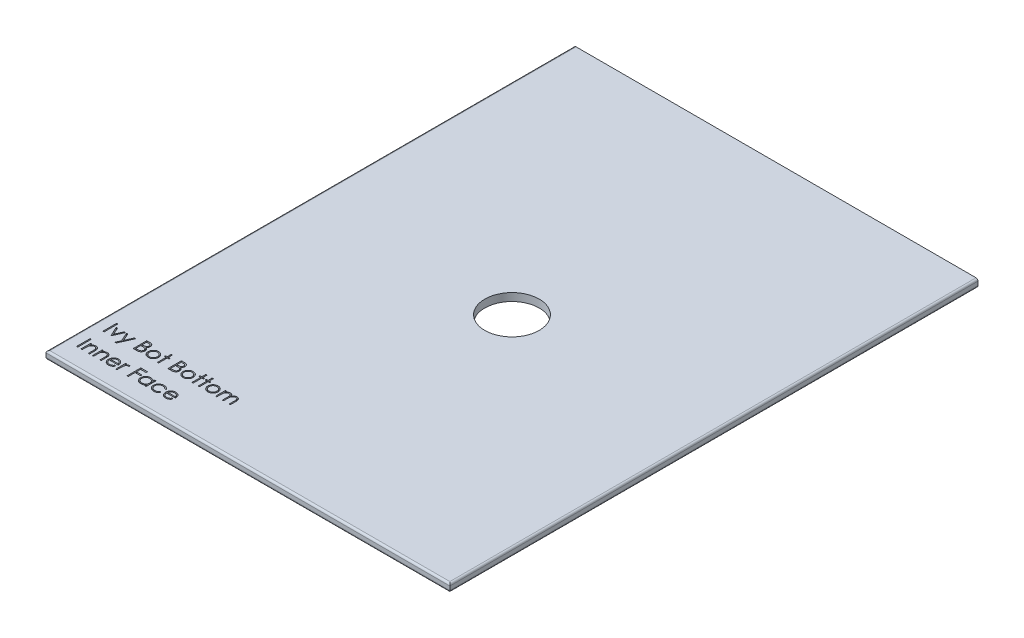
from build123d import *

# Parameters (mm, degrees)
SKETCH1_W           = 104
SKETCH1_H           = 136
BOSS_EXTRUDE1_DEPTH = 2
SKETCH6_R           = 7
CUT_EXTRUDE1_DEPTH  = 86.627098514
FILLET1_R           = 0.5
SKETCH9_W           = 0.314102564
SKETCH9_H           = 3.5
CUT_EXTRUDE4_DEPTH  = 1
CUT_EXTRUDE5_DEPTH  = 1
SKETCH11_R          = 2.5
BOSS_EXTRUDE2_DEPTH = 10
FILLET4_R           = 2


with BuildPart() as part:
    # Sketch1 → Boss-Extrude1 (new body)
    with BuildSketch(Plane(origin=(0, 0, 0), x_dir=(1, 0, 0), z_dir=(0, 1, 0))):
        Rectangle(SKETCH1_W, SKETCH1_H)
    extrude(amount=BOSS_EXTRUDE1_DEPTH)

    # Sketch6 → Cut-Extrude1 (cut, through all)
    with BuildSketch(Plane(origin=(0, 2, 0), x_dir=(1, 0, 0), z_dir=(0, 1, 0))):
        with Locations(Location((0, 0, 0), (0, 0, 270))):
            Circle(SKETCH6_R)
    extrude(amount=-CUT_EXTRUDE1_DEPTH, mode=Mode.SUBTRACT)

    # Fillet1
    fillet1_edges = [part.edges().sort_by_distance(p)[0] for p in [
        (52, 2, 0),
        (-52, 2, 0),
        (0, 0, -68),
        (52, 0, 0),
        (0, 0, 68),
        (-52, 0, 0),
        (0, 2, 68),
    ]]
    fillet(fillet1_edges, radius=FILLET1_R)

    # Sketch9 → Cut-Extrude4 (cut)
    # profile 1 of 21: a face of its own
    with BuildSketch(Plane(origin=(0, 2, 0), x_dir=(1, 0, 0), z_dir=(0, 1, 0))):
        with Locations((-48.84313938, -54.561589843)):
            Rectangle(SKETCH9_W, SKETCH9_H)
    # profile 2 of 21: a face of its own
    with BuildSketch(Plane(origin=(0, 2, 0), x_dir=(1, 0, 0), z_dir=(0, 1, 0))):
        Polygon((-48.147626559, -53.753897536), (-47.807582489, -53.753897536), (-46.958523995, -55.616077023), (-46.109465501, -53.753897536), (-45.769421431, -53.753897536), (-46.936088098, -56.311589843), (-46.980959892, -56.311589843), align=None)
    # profile 3 of 21: a face of its own
    with BuildSketch(Plane(origin=(0, 2, 0), x_dir=(1, 0, 0), z_dir=(0, 1, 0))):
        Polygon((-45.500190662, -53.753897536), (-45.161548835, -53.753897536), (-44.295663418, -55.712831831), (-43.416456687, -53.753897536), (-43.077113739, -53.753897536), (-44.647626559, -57.253897536), (-44.986969508, -57.253897536), (-44.466036014, -56.093540965), align=None)
    # profile 4 of 21: a face of its own
    with BuildSketch(Plane(origin=(0, 2, 0), x_dir=(1, 0, 0), z_dir=(0, 1, 0))):
        with BuildLine():
            Line((-41.237370149, -52.811589843), (-40.554477521, -52.811589843))
            add(Edge.make_bspline(
                [(-40.554477521, -52.811589843), (-40.521049042, -52.811765594), (-40.456256332, -52.812106242), (-40.36203689, -52.817389373), (-40.27378808, -52.824593043), (-40.191484307, -52.836023136), (-40.115163605, -52.849814913), (-40.044595968, -52.866516729), (-39.980005795, -52.886543342), (-39.902893059, -52.918389624), (-39.814972398, -52.965712792), (-39.719774005, -53.035641357), (-39.638369766, -53.12117382), (-39.568183449, -53.217656476), (-39.512382329, -53.323792247), (-39.472013032, -53.437051436), (-39.446455157, -53.555973178), (-39.443826722, -53.637616356), (-39.442498354, -53.678877504)],
                knots=[0, 0, 0, 0, 1.001505555, 1.941167018, 2.826882275, 3.653841531, 4.429895133, 5.150066043, 5.825578002, 6.45369114, 7.647487171, 8.808567382, 9.977351308, 11.170798116, 12.373658725, 13.556498008, 14.765093433, 16, 16, 16, 16], degree=3))
            add(Edge.make_bspline(
                [(-39.442498354, -53.678877504), (-39.443591572, -53.717530059), (-39.44573985, -53.793485976), (-39.466282609, -53.904580086), (-39.498443278, -54.010331304), (-39.543148527, -54.11035369), (-39.601250523, -54.202387303), (-39.670108842, -54.287174569), (-39.753185644, -54.361125626), (-39.815428884, -54.402468529), (-39.84704563, -54.42346885)],
                knots=[0, 0, 0, 0, 1.044552857, 2.05264487, 3.044412934, 4.028983338, 5.005914585, 5.980388656, 6.974128949, 8, 8, 8, 8], degree=3))
            add(Edge.make_bspline(
                [(-39.84704563, -54.42346885), (-39.807285202, -54.438733849), (-39.731213655, -54.467939573), (-39.626527642, -54.519575037), (-39.536332797, -54.575737148), (-39.459935651, -54.637068998), (-39.394597996, -54.703177808), (-39.337545055, -54.775032923), (-39.288863681, -54.853571681), (-39.247150757, -54.937975216), (-39.214602001, -55.027381684), (-39.190226097, -55.12095246), (-39.176258648, -55.218352016), (-39.174271006, -55.284637395), (-39.173267585, -55.31810026)],
                knots=[0, 0, 0, 0, 1.27268992, 2.434971085, 3.483601985, 4.442670788, 5.356604649, 6.2567628, 7.179492994, 8.113709626, 9.066344395, 10.018646069, 10.999752585, 12, 12, 12, 12], degree=3))
            add(Edge.make_bspline(
                [(-39.173267585, -55.31810026), (-39.174244431, -55.352267132), (-39.176166403, -55.41949141), (-39.190346375, -55.518246545), (-39.214355481, -55.612621491), (-39.247426628, -55.703226674), (-39.290588942, -55.789886809), (-39.343116907, -55.872700073), (-39.40574847, -55.950834403), (-39.475811339, -56.025158026), (-39.555073485, -56.091985814), (-39.64058924, -56.15150152), (-39.73343556, -56.200447582), (-39.832087554, -56.241563604), (-39.93765187, -56.272970802), (-40.049654477, -56.294943376), (-40.167998779, -56.309748413), (-40.24920853, -56.310965618), (-40.290855726, -56.311589843)],
                knots=[0, 0, 0, 0, 0.978564426, 1.925352924, 2.850884081, 3.763762016, 4.682927383, 5.618979971, 6.567305752, 7.547517671, 8.540179244, 9.531824382, 10.526200242, 11.540722885, 12.589160233, 13.674978461, 14.80764778, 16, 16, 16, 16], degree=3))
            Line((-40.290855726, -56.311589843), (-41.237370149, -56.311589843))
            Line((-41.237370149, -56.311589843), (-41.237370149, -52.811589843))
        make_face()
        with BuildLine():
            Line((-40.923267585, -53.170564202), (-40.923267585, -54.292359074))
            Line((-40.923267585, -54.292359074), (-40.712229925, -54.292359074))
            add(Edge.make_bspline(
                [(-40.712229925, -54.292359074), (-40.681381129, -54.291959151), (-40.62177497, -54.291186418), (-40.535455073, -54.288972901), (-40.455330055, -54.282774858), (-40.381538222, -54.276578596), (-40.314195778, -54.266504008), (-40.253451917, -54.254511885), (-40.19835332, -54.24182898), (-40.134813774, -54.220259493), (-40.062740826, -54.188381818), (-39.985907722, -54.138909982), (-39.918173252, -54.079985629), (-39.860976064, -54.011994667), (-39.814164594, -53.937128481), (-39.781650879, -53.856581601), (-39.759603594, -53.772361469), (-39.757612063, -53.714543216), (-39.756600918, -53.6851876)],
                knots=[0, 0, 0, 0, 1.156816544, 2.235205308, 3.236616184, 4.169592532, 5.011045266, 5.787822928, 6.49130361, 7.128639758, 8.301311294, 9.436451833, 10.541879658, 11.654887649, 12.756523258, 13.837046038, 14.901820046, 16, 16, 16, 16], degree=3))
            add(Edge.make_bspline(
                [(-39.756600918, -53.6851876), (-39.757127098, -53.665761828), (-39.758159258, -53.627656056), (-39.766612561, -53.572106702), (-39.780980135, -53.51986295), (-39.799434428, -53.470208839), (-39.825223117, -53.424696989), (-39.85558658, -53.381753793), (-39.892272271, -53.342841675), (-39.934029583, -53.306472176), (-39.982038206, -53.274227649), (-40.036269498, -53.245986886), (-40.097457175, -53.223246109), (-40.16457003, -53.203329956), (-40.238641118, -53.189341663), (-40.318815671, -53.177688275), (-40.40575039, -53.171755533), (-40.465895493, -53.17097017), (-40.496985533, -53.170564202)],
                knots=[0, 0, 0, 0, 0.91205012, 1.789085906, 2.630437955, 3.453916878, 4.269457761, 5.079663411, 5.91843418, 6.774407191, 7.675494373, 8.627863946, 9.638891023, 10.736472738, 11.911756761, 13.175263542, 14.539845004, 16, 16, 16, 16], degree=3))
            Line((-40.496985533, -53.170564202), (-40.923267585, -53.170564202))
        make_face(mode=Mode.SUBTRACT)
        with BuildLine():
            Line((-40.923267585, -54.651333433), (-40.923267585, -55.952615484))
            Line((-40.923267585, -55.952615484), (-40.47595188, -55.952615484))
            add(Edge.make_bspline(
                [(-40.47595188, -55.952615484), (-40.443932954, -55.952231737), (-40.382220695, -55.951492115), (-40.293119465, -55.94907756), (-40.210536361, -55.943585284), (-40.134848226, -55.934939435), (-40.065237773, -55.925560985), (-40.00254007, -55.912949705), (-39.946246876, -55.898500744), (-39.880972569, -55.876166572), (-39.80746906, -55.841470101), (-39.728258204, -55.789155874), (-39.657831986, -55.726832567), (-39.598026727, -55.654701652), (-39.549013738, -55.576270326), (-39.513358283, -55.493124976), (-39.491367426, -55.406639448), (-39.488705257, -55.347672736), (-39.487370149, -55.31810026)],
                knots=[0, 0, 0, 0, 1.160039823, 2.235823828, 3.228722157, 4.157150951, 4.99529583, 5.772374946, 6.472645482, 7.099169577, 8.269452708, 9.405989375, 10.527446681, 11.663510218, 12.788923519, 13.866172445, 14.929861265, 16, 16, 16, 16], degree=3))
            add(Edge.make_bspline(
                [(-39.487370149, -55.31810026), (-39.487646253, -55.29960692), (-39.488194008, -55.262918538), (-39.496454623, -55.209002719), (-39.508468493, -55.156776845), (-39.523999927, -55.106099105), (-39.546619394, -55.057885728), (-39.573025939, -55.011183169), (-39.603987341, -54.965929689), (-39.652231507, -54.908717436), (-39.722403491, -54.842800423), (-39.822110266, -54.778262921), (-39.935482564, -54.726215114), (-40.017710057, -54.704115637), (-40.060186655, -54.692699619)],
                knots=[0, 0, 0, 0, 0.723448775, 1.435228256, 2.130040452, 2.821711965, 3.505591119, 4.210454504, 4.921174351, 5.648778258, 7.137944449, 8.670945889, 10.280296675, 12, 12, 12, 12], degree=3))
            add(Edge.make_bspline(
                [(-40.060186655, -54.692699619), (-40.077215751, -54.689244535), (-40.114138343, -54.6817532), (-40.174345924, -54.673845497), (-40.243081793, -54.666800437), (-40.32050467, -54.661589279), (-40.406712511, -54.656202736), (-40.50188943, -54.654107915), (-40.605646745, -54.651608655), (-40.677639117, -54.65142752), (-40.715034412, -54.651333433)],
                knots=[0, 0, 0, 0, 0.634451884, 1.375622551, 2.216452059, 3.157844607, 4.20941857, 5.370758133, 6.634282058, 8, 8, 8, 8], degree=3))
            Line((-40.715034412, -54.651333433), (-40.923267585, -54.651333433))
        make_face(mode=Mode.SUBTRACT)
    # profile 5 of 21: a face of its own
    with BuildSketch(Plane(origin=(0, 2, 0), x_dir=(1, 0, 0), z_dir=(0, 1, 0))):
        with BuildLine():
            add(Edge.make_bspline(
                [(-37.309685854, -53.709025741), (-37.261694581, -53.710047632), (-37.167595424, -53.712051311), (-37.029787538, -53.733466276), (-36.898242402, -53.766213641), (-36.77245621, -53.811485203), (-36.654039914, -53.872167153), (-36.54126867, -53.944576445), (-36.434451661, -54.030359038), (-36.370428632, -54.096717106), (-36.337931046, -54.13039994)],
                knots=[0, 0, 0, 0, 1.054011418, 2.066658804, 3.057071809, 4.030435133, 4.997543892, 5.974964718, 6.972108034, 8, 8, 8, 8], degree=3))
            add(Edge.make_bspline(
                [(-36.337931046, -54.13039994), (-36.309949092, -54.162613925), (-36.254526712, -54.226418468), (-36.183460993, -54.329874081), (-36.122239433, -54.437014181), (-36.073176472, -54.549261508), (-36.034491448, -54.665636179), (-36.007025752, -54.78653819), (-35.990688817, -54.911700537), (-35.98848585, -54.996704375), (-35.987370149, -55.039754908)],
                knots=[0, 0, 0, 0, 1.025258237, 2.030674902, 3.01204498, 3.988269485, 4.97094183, 5.956517959, 6.965070386, 8, 8, 8, 8], degree=3))
            add(Edge.make_bspline(
                [(-35.987370149, -55.039754908), (-35.988351486, -55.083054965), (-35.990290654, -55.168617899), (-36.008634271, -55.294637264), (-36.037165357, -55.416832087), (-36.077997195, -55.534690781), (-36.130355304, -55.648573608), (-36.194245992, -55.757983157), (-36.270117609, -55.863135291), (-36.356121606, -55.963137129), (-36.451173482, -56.055303344), (-36.55428963, -56.135631613), (-36.663443664, -56.204453138), (-36.780087017, -56.259889553), (-36.903154504, -56.303599254), (-37.032911572, -56.33429927), (-37.169156642, -56.352860954), (-37.262183864, -56.355244527), (-37.309685854, -56.356461638)],
                knots=[0, 0, 0, 0, 0.998656419, 1.973391657, 2.932242238, 3.890759089, 4.846373663, 5.82037756, 6.809684879, 7.83454468, 8.860553229, 9.859544525, 10.845671541, 11.83227036, 12.833544569, 13.85385346, 14.904124723, 16, 16, 16, 16], degree=3))
            add(Edge.make_bspline(
                [(-37.309685854, -56.356461638), (-37.357420574, -56.355240442), (-37.450911433, -56.352848668), (-37.587637415, -56.334371385), (-37.717627034, -56.303613402), (-37.840855633, -56.25974591), (-37.95800048, -56.204451366), (-38.067786977, -56.135839676), (-38.170986892, -56.055279521), (-38.266058876, -55.963143584), (-38.352057482, -55.863133628), (-38.42793049, -55.757983589), (-38.491820816, -55.648573496), (-38.54417902, -55.534690811), (-38.585010833, -55.416832079), (-38.613541926, -55.294637266), (-38.63188554, -55.168617898), (-38.633824709, -55.083054965), (-38.634806046, -55.039754908)],
                knots=[0, 0, 0, 0, 1.099876186, 2.154163076, 3.173186993, 4.173200201, 5.163417411, 6.152872554, 7.150605724, 8.17532212, 9.198891216, 10.186952605, 11.159729845, 12.11414092, 13.071450619, 14.029093627, 15.002601286, 16, 16, 16, 16], degree=3))
            add(Edge.make_bspline(
                [(-38.634806046, -55.039754908), (-38.633682736, -54.996938362), (-38.631458775, -54.912168959), (-38.615138265, -54.787241899), (-38.587779709, -54.66654451), (-38.549048312, -54.550619034), (-38.499533122, -54.438863597), (-38.439171834, -54.331458766), (-38.367381201, -54.228470966), (-38.31217925, -54.164748886), (-38.284245149, -54.132503305)],
                knots=[0, 0, 0, 0, 1.031353054, 2.041901799, 3.029428768, 4.008703097, 4.981709435, 5.96992636, 6.972712378, 8, 8, 8, 8], degree=3))
            add(Edge.make_bspline(
                [(-38.284245149, -54.132503305), (-38.251796558, -54.098528366), (-38.187980694, -54.031710669), (-38.080631966, -53.946178145), (-37.968138145, -53.872262072), (-37.848413219, -53.812785856), (-37.722730361, -53.765947338), (-37.590511119, -53.733381823), (-37.452235603, -53.712128468), (-37.357675982, -53.71007029), (-37.309685854, -53.709025741)],
                knots=[0, 0, 0, 0, 1.027980169, 2.021703884, 2.998553061, 3.971491411, 4.943284454, 5.930300938, 6.949603206, 8, 8, 8, 8], degree=3))
        make_face()
        with BuildLine():
            add(Edge.make_bspline(
                [(-37.311088098, -54.023128305), (-37.345025709, -54.024092897), (-37.412024838, -54.025997179), (-37.510644422, -54.040481084), (-37.605584576, -54.063428588), (-37.69702542, -54.096032644), (-37.784658593, -54.138131543), (-37.868567995, -54.189839903), (-37.949000435, -54.25047286), (-38.024382498, -54.319935531), (-38.093564811, -54.395814526), (-38.154042787, -54.476662885), (-38.205467894, -54.561169231), (-38.248308053, -54.649421442), (-38.280215241, -54.742313856), (-38.303388263, -54.838794487), (-38.317858504, -54.939059904), (-38.319744882, -55.007220922), (-38.320703482, -55.041858273)],
                knots=[0, 0, 0, 0, 1.021534396, 2.016698045, 2.994645724, 3.958388632, 4.93408049, 5.916473867, 6.921342795, 7.962252576, 8.998418191, 10.008913653, 10.997312074, 11.973003931, 12.956656626, 13.948281152, 14.957379055, 16, 16, 16, 16], degree=3))
            add(Edge.make_bspline(
                [(-38.320703482, -55.041858273), (-38.319096659, -55.0866103), (-38.315907414, -55.175434706), (-38.289972178, -55.306245828), (-38.246585898, -55.43182768), (-38.187998618, -55.551444066), (-38.114592399, -55.662116344), (-38.028105333, -55.760787829), (-37.929465632, -55.84597364), (-37.819849132, -55.916654486), (-37.701494814, -55.972814241), (-37.576238493, -56.012613217), (-37.445597799, -56.03848491), (-37.356317068, -56.041056384), (-37.311088098, -56.042359074)],
                knots=[0, 0, 0, 0, 1.016792936, 2.018143844, 3.017858371, 4.030088057, 5.03801393, 6.028138512, 7.003788237, 7.991172063, 8.984598303, 9.972568034, 10.972917682, 12, 12, 12, 12], degree=3))
            add(Edge.make_bspline(
                [(-37.311088098, -56.042359074), (-37.265861729, -56.041048794), (-37.176586133, -56.038462337), (-37.046126956, -56.012743517), (-36.921212984, -55.972639857), (-36.802981596, -55.916717647), (-36.693414993, -55.845705232), (-36.594065872, -55.761268855), (-36.508317261, -55.661855004), (-36.434983656, -55.551297475), (-36.375436913, -55.432013123), (-36.332253711, -55.30622265), (-36.306256125, -55.175440608), (-36.303075297, -55.086612278), (-36.301472713, -55.041858273)],
                knots=[0, 0, 0, 0, 1.02726834, 2.027799167, 3.010890988, 4.004497153, 4.992059811, 5.971914811, 6.958719428, 7.966827853, 8.981595046, 9.981490638, 10.983022906, 12, 12, 12, 12], degree=3))
            add(Edge.make_bspline(
                [(-36.301472713, -55.041858273), (-36.302430983, -55.007220715), (-36.304316712, -54.93905929), (-36.318791676, -54.838796836), (-36.341947216, -54.742305239), (-36.373918833, -54.649453236), (-36.416572847, -54.560940732), (-36.46898964, -54.476911005), (-36.529220666, -54.395534459), (-36.599237787, -54.320180818), (-36.674541165, -54.250445781), (-36.755006203, -54.189816392), (-36.838791181, -54.138358796), (-36.926169764, -54.095672556), (-37.017622332, -54.063725215), (-37.112429461, -54.040348584), (-37.210628271, -54.026058387), (-37.277387314, -54.024111246), (-37.311088098, -54.023128305)],
                knots=[0, 0, 0, 0, 1.042956736, 2.052379634, 3.044323526, 4.02829302, 5.004299113, 5.996692471, 7.007513377, 8.048758398, 9.090003419, 10.095195979, 11.07790575, 12.047570684, 13.018257071, 13.989683339, 14.985167495, 16, 16, 16, 16], degree=3))
        make_face(mode=Mode.SUBTRACT)
    # profile 6 of 21: a face of its own
    with BuildSketch(Plane(origin=(0, 2, 0), x_dir=(1, 0, 0), z_dir=(0, 1, 0))):
        Polygon((-35.045062457, -52.721846254), (-34.730959892, -52.721846254), (-34.730959892, -53.753897536), (-34.282241944, -53.753897536), (-34.282241944, -54.0680001), (-34.730959892, -54.0680001), (-34.730959892, -56.311589843), (-35.045062457, -56.311589843), (-35.045062457, -54.0680001), (-35.493780405, -54.0680001), (-35.493780405, -53.753897536), (-35.045062457, -53.753897536), align=None)
    # profile 7 of 21: a face of its own
    with BuildSketch(Plane(origin=(0, 2, 0), x_dir=(1, 0, 0), z_dir=(0, 1, 0))):
        with BuildLine():
            Line((-32.307882969, -52.811589843), (-31.624990341, -52.811589843))
            add(Edge.make_bspline(
                [(-31.624990341, -52.811589843), (-31.591561863, -52.811765594), (-31.526769153, -52.812106242), (-31.432549711, -52.817389373), (-31.3443009, -52.824593043), (-31.261997128, -52.836023136), (-31.185676425, -52.849814913), (-31.115108788, -52.866516729), (-31.050518616, -52.886543342), (-30.97340588, -52.918389624), (-30.885485219, -52.965712792), (-30.790286826, -53.035641357), (-30.708882587, -53.12117382), (-30.638696269, -53.217656476), (-30.58289515, -53.323792247), (-30.542525852, -53.437051436), (-30.516967977, -53.555973178), (-30.514339543, -53.637616356), (-30.513011175, -53.678877504)],
                knots=[0, 0, 0, 0, 1.001505555, 1.941167018, 2.826882275, 3.653841531, 4.429895133, 5.150066043, 5.825578002, 6.45369114, 7.647487171, 8.808567382, 9.977351308, 11.170798116, 12.373658725, 13.556498008, 14.765093433, 16, 16, 16, 16], degree=3))
            add(Edge.make_bspline(
                [(-30.513011175, -53.678877504), (-30.514104393, -53.717530059), (-30.51625267, -53.793485976), (-30.53679543, -53.904580086), (-30.568956098, -54.010331304), (-30.613661347, -54.11035369), (-30.671763343, -54.202387303), (-30.740621662, -54.287174569), (-30.823698465, -54.361125626), (-30.885941705, -54.402468529), (-30.91755845, -54.42346885)],
                knots=[0, 0, 0, 0, 1.044552857, 2.05264487, 3.044412934, 4.028983338, 5.005914585, 5.980388656, 6.974128949, 8, 8, 8, 8], degree=3))
            add(Edge.make_bspline(
                [(-30.91755845, -54.42346885), (-30.877798023, -54.438733849), (-30.801726475, -54.467939573), (-30.697040463, -54.519575037), (-30.606845618, -54.575737148), (-30.530448472, -54.637068998), (-30.465110817, -54.703177808), (-30.408057875, -54.775032923), (-30.359376501, -54.853571681), (-30.317663578, -54.937975216), (-30.285114822, -55.027381684), (-30.260738917, -55.12095246), (-30.246771468, -55.218352016), (-30.244783827, -55.284637395), (-30.243780405, -55.31810026)],
                knots=[0, 0, 0, 0, 1.27268992, 2.434971085, 3.483601985, 4.442670788, 5.356604649, 6.2567628, 7.179492994, 8.113709626, 9.066344395, 10.018646069, 10.999752585, 12, 12, 12, 12], degree=3))
            add(Edge.make_bspline(
                [(-30.243780405, -55.31810026), (-30.244757251, -55.352267132), (-30.246679223, -55.41949141), (-30.260859195, -55.518246545), (-30.284868302, -55.612621491), (-30.317939448, -55.703226674), (-30.361101763, -55.789886809), (-30.413629727, -55.872700073), (-30.476261291, -55.950834403), (-30.54632416, -56.025158026), (-30.625586305, -56.091985814), (-30.71110206, -56.15150152), (-30.80394838, -56.200447582), (-30.902600374, -56.241563604), (-31.00816469, -56.272970802), (-31.120167298, -56.294943376), (-31.2385116, -56.309748413), (-31.319721351, -56.310965618), (-31.361368546, -56.311589843)],
                knots=[0, 0, 0, 0, 0.978564426, 1.925352924, 2.850884081, 3.763762016, 4.682927383, 5.618979971, 6.567305752, 7.547517671, 8.540179244, 9.531824382, 10.526200242, 11.540722885, 12.589160233, 13.674978461, 14.80764778, 16, 16, 16, 16], degree=3))
            Line((-31.361368546, -56.311589843), (-32.307882969, -56.311589843))
            Line((-32.307882969, -56.311589843), (-32.307882969, -52.811589843))
        make_face()
        with BuildLine():
            Line((-31.993780405, -53.170564202), (-31.993780405, -54.292359074))
            Line((-31.993780405, -54.292359074), (-31.782742745, -54.292359074))
            add(Edge.make_bspline(
                [(-31.782742745, -54.292359074), (-31.75189395, -54.291959151), (-31.69228779, -54.291186418), (-31.605967894, -54.288972901), (-31.525842876, -54.282774858), (-31.452051043, -54.276578596), (-31.384708599, -54.266504008), (-31.323964737, -54.254511885), (-31.26886614, -54.24182898), (-31.205326595, -54.220259493), (-31.133253646, -54.188381818), (-31.056420542, -54.138909982), (-30.988686072, -54.079985629), (-30.931488885, -54.011994667), (-30.884677414, -53.937128481), (-30.852163699, -53.856581601), (-30.830116415, -53.772361469), (-30.828124883, -53.714543216), (-30.827113739, -53.6851876)],
                knots=[0, 0, 0, 0, 1.156816544, 2.235205308, 3.236616184, 4.169592532, 5.011045266, 5.787822928, 6.49130361, 7.128639758, 8.301311294, 9.436451833, 10.541879658, 11.654887649, 12.756523258, 13.837046038, 14.901820046, 16, 16, 16, 16], degree=3))
            add(Edge.make_bspline(
                [(-30.827113739, -53.6851876), (-30.827639919, -53.665761828), (-30.828672079, -53.627656056), (-30.837125381, -53.572106702), (-30.851492956, -53.51986295), (-30.869947249, -53.470208839), (-30.895735938, -53.424696989), (-30.926099401, -53.381753793), (-30.962785091, -53.342841675), (-31.004542404, -53.306472176), (-31.052551027, -53.274227649), (-31.106782319, -53.245986886), (-31.167969996, -53.223246109), (-31.235082851, -53.203329956), (-31.309153938, -53.189341663), (-31.389328492, -53.177688275), (-31.476263211, -53.171755533), (-31.536408313, -53.17097017), (-31.567498354, -53.170564202)],
                knots=[0, 0, 0, 0, 0.91205012, 1.789085906, 2.630437955, 3.453916878, 4.269457761, 5.079663411, 5.91843418, 6.774407191, 7.675494373, 8.627863946, 9.638891023, 10.736472738, 11.911756761, 13.175263542, 14.539845004, 16, 16, 16, 16], degree=3))
            Line((-31.567498354, -53.170564202), (-31.993780405, -53.170564202))
        make_face(mode=Mode.SUBTRACT)
        with BuildLine():
            Line((-31.993780405, -54.651333433), (-31.993780405, -55.952615484))
            Line((-31.993780405, -55.952615484), (-31.5464647, -55.952615484))
            add(Edge.make_bspline(
                [(-31.5464647, -55.952615484), (-31.514445774, -55.952231737), (-31.452733516, -55.951492115), (-31.363632286, -55.94907756), (-31.281049182, -55.943585284), (-31.205361046, -55.934939435), (-31.135750593, -55.925560985), (-31.07305289, -55.912949705), (-31.016759697, -55.898500744), (-30.951485389, -55.876166572), (-30.877981881, -55.841470101), (-30.798771024, -55.789155874), (-30.728344806, -55.726832567), (-30.668539547, -55.654701652), (-30.619526559, -55.576270326), (-30.583871104, -55.493124976), (-30.561880247, -55.406639448), (-30.559218077, -55.347672736), (-30.557882969, -55.31810026)],
                knots=[0, 0, 0, 0, 1.160039823, 2.235823828, 3.228722157, 4.157150951, 4.99529583, 5.772374946, 6.472645482, 7.099169577, 8.269452708, 9.405989375, 10.527446681, 11.663510218, 12.788923519, 13.866172445, 14.929861265, 16, 16, 16, 16], degree=3))
            add(Edge.make_bspline(
                [(-30.557882969, -55.31810026), (-30.558159074, -55.29960692), (-30.558706829, -55.262918538), (-30.566967444, -55.209002719), (-30.578981314, -55.156776845), (-30.594512747, -55.106099105), (-30.617132215, -55.057885728), (-30.64353876, -55.011183169), (-30.674500161, -54.965929689), (-30.722744327, -54.908717436), (-30.792916312, -54.842800423), (-30.892623087, -54.778262921), (-31.005995385, -54.726215114), (-31.088222878, -54.704115637), (-31.130699476, -54.692699619)],
                knots=[0, 0, 0, 0, 0.723448775, 1.435228256, 2.130040452, 2.821711965, 3.505591119, 4.210454504, 4.921174351, 5.648778258, 7.137944449, 8.670945889, 10.280296675, 12, 12, 12, 12], degree=3))
            add(Edge.make_bspline(
                [(-31.130699476, -54.692699619), (-31.147728572, -54.689244535), (-31.184651164, -54.6817532), (-31.244858744, -54.673845497), (-31.313594613, -54.666800437), (-31.391017491, -54.661589279), (-31.477225332, -54.656202736), (-31.57240225, -54.654107915), (-31.676159565, -54.651608655), (-31.748151937, -54.65142752), (-31.785547232, -54.651333433)],
                knots=[0, 0, 0, 0, 0.634451884, 1.375622551, 2.216452059, 3.157844607, 4.20941857, 5.370758133, 6.634282058, 8, 8, 8, 8], degree=3))
            Line((-31.785547232, -54.651333433), (-31.993780405, -54.651333433))
        make_face(mode=Mode.SUBTRACT)
    # profile 8 of 21: a face of its own
    with BuildSketch(Plane(origin=(0, 2, 0), x_dir=(1, 0, 0), z_dir=(0, 1, 0))):
        with BuildLine():
            add(Edge.make_bspline(
                [(-28.380198675, -53.709025741), (-28.332207402, -53.710047632), (-28.238108244, -53.712051311), (-28.100300358, -53.733466276), (-27.968755222, -53.766213641), (-27.84296903, -53.811485203), (-27.724552735, -53.872167153), (-27.611781491, -53.944576445), (-27.504964482, -54.030359038), (-27.440941452, -54.096717106), (-27.408443867, -54.13039994)],
                knots=[0, 0, 0, 0, 1.054011418, 2.066658804, 3.057071809, 4.030435133, 4.997543892, 5.974964718, 6.972108034, 8, 8, 8, 8], degree=3))
            add(Edge.make_bspline(
                [(-27.408443867, -54.13039994), (-27.380461913, -54.162613925), (-27.325039533, -54.226418468), (-27.253973814, -54.329874081), (-27.192752254, -54.437014181), (-27.143689293, -54.549261508), (-27.105004269, -54.665636179), (-27.077538573, -54.78653819), (-27.061201638, -54.911700537), (-27.058998671, -54.996704375), (-27.057882969, -55.039754908)],
                knots=[0, 0, 0, 0, 1.025258237, 2.030674902, 3.01204498, 3.988269485, 4.97094183, 5.956517959, 6.965070386, 8, 8, 8, 8], degree=3))
            add(Edge.make_bspline(
                [(-27.057882969, -55.039754908), (-27.058864307, -55.083054965), (-27.060803475, -55.168617899), (-27.079147091, -55.294637264), (-27.107678177, -55.416832087), (-27.148510015, -55.534690781), (-27.200868125, -55.648573608), (-27.264758812, -55.757983157), (-27.340630429, -55.863135291), (-27.426634426, -55.963137129), (-27.521686302, -56.055303344), (-27.624802451, -56.135631613), (-27.733956484, -56.204453138), (-27.850599838, -56.259889553), (-27.973667324, -56.303599254), (-28.103424393, -56.33429927), (-28.239669463, -56.352860954), (-28.332696684, -56.355244527), (-28.380198675, -56.356461638)],
                knots=[0, 0, 0, 0, 0.998656419, 1.973391657, 2.932242238, 3.890759089, 4.846373663, 5.82037756, 6.809684879, 7.83454468, 8.860553229, 9.859544525, 10.845671541, 11.83227036, 12.833544569, 13.85385346, 14.904124723, 16, 16, 16, 16], degree=3))
            add(Edge.make_bspline(
                [(-28.380198675, -56.356461638), (-28.427933394, -56.355240442), (-28.521424254, -56.352848668), (-28.658150236, -56.334371385), (-28.788139855, -56.303613402), (-28.911368453, -56.25974591), (-29.0285133, -56.204451366), (-29.138299797, -56.135839676), (-29.241499713, -56.055279521), (-29.336571697, -55.963143584), (-29.422570302, -55.863133628), (-29.498443311, -55.757983589), (-29.562333637, -55.648573496), (-29.614691841, -55.534690811), (-29.655523654, -55.416832079), (-29.684054746, -55.294637266), (-29.702398361, -55.168617898), (-29.704337529, -55.083054965), (-29.705318867, -55.039754908)],
                knots=[0, 0, 0, 0, 1.099876186, 2.154163076, 3.173186993, 4.173200201, 5.163417411, 6.152872554, 7.150605724, 8.17532212, 9.198891216, 10.186952605, 11.159729845, 12.11414092, 13.071450619, 14.029093627, 15.002601286, 16, 16, 16, 16], degree=3))
            add(Edge.make_bspline(
                [(-29.705318867, -55.039754908), (-29.704195556, -54.996938362), (-29.701971595, -54.912168959), (-29.685651086, -54.787241899), (-29.658292529, -54.66654451), (-29.619561133, -54.550619034), (-29.570045942, -54.438863597), (-29.509684654, -54.331458766), (-29.437894022, -54.228470966), (-29.38269207, -54.164748886), (-29.354757969, -54.132503305)],
                knots=[0, 0, 0, 0, 1.031353054, 2.041901799, 3.029428768, 4.008703097, 4.981709435, 5.96992636, 6.972712378, 8, 8, 8, 8], degree=3))
            add(Edge.make_bspline(
                [(-29.354757969, -54.132503305), (-29.322309378, -54.098528366), (-29.258493515, -54.031710669), (-29.151144787, -53.946178145), (-29.038650966, -53.872262072), (-28.91892604, -53.812785856), (-28.793243182, -53.765947338), (-28.661023939, -53.733381823), (-28.522748424, -53.712128468), (-28.428188802, -53.71007029), (-28.380198675, -53.709025741)],
                knots=[0, 0, 0, 0, 1.027980169, 2.021703884, 2.998553061, 3.971491411, 4.943284454, 5.930300938, 6.949603206, 8, 8, 8, 8], degree=3))
        make_face()
        with BuildLine():
            add(Edge.make_bspline(
                [(-28.381600918, -54.023128305), (-28.415538529, -54.024092897), (-28.482537658, -54.025997179), (-28.581157243, -54.040481084), (-28.676097397, -54.063428588), (-28.767538241, -54.096032644), (-28.855171413, -54.138131543), (-28.939080816, -54.189839903), (-29.019513256, -54.25047286), (-29.094895319, -54.319935531), (-29.164077631, -54.395814526), (-29.224555608, -54.476662885), (-29.275980714, -54.561169231), (-29.318820873, -54.649421442), (-29.350728061, -54.742313856), (-29.373901084, -54.838794487), (-29.388371324, -54.939059904), (-29.390257703, -55.007220922), (-29.391216303, -55.041858273)],
                knots=[0, 0, 0, 0, 1.021534396, 2.016698045, 2.994645724, 3.958388632, 4.93408049, 5.916473867, 6.921342795, 7.962252576, 8.998418191, 10.008913653, 10.997312074, 11.973003931, 12.956656626, 13.948281152, 14.957379055, 16, 16, 16, 16], degree=3))
            add(Edge.make_bspline(
                [(-29.391216303, -55.041858273), (-29.389609479, -55.0866103), (-29.386420235, -55.175434706), (-29.360484998, -55.306245828), (-29.317098718, -55.43182768), (-29.258511439, -55.551444066), (-29.18510522, -55.662116344), (-29.098618153, -55.760787829), (-28.999978453, -55.84597364), (-28.890361953, -55.916654486), (-28.772007635, -55.972814241), (-28.646751314, -56.012613217), (-28.51611062, -56.03848491), (-28.426829888, -56.041056384), (-28.381600918, -56.042359074)],
                knots=[0, 0, 0, 0, 1.016792936, 2.018143844, 3.017858371, 4.030088057, 5.03801393, 6.028138512, 7.003788237, 7.991172063, 8.984598303, 9.972568034, 10.972917682, 12, 12, 12, 12], degree=3))
            add(Edge.make_bspline(
                [(-28.381600918, -56.042359074), (-28.336374549, -56.041048794), (-28.247098953, -56.038462337), (-28.116639776, -56.012743517), (-27.991725804, -55.972639857), (-27.873494417, -55.916717647), (-27.763927814, -55.845705232), (-27.664578692, -55.761268855), (-27.578830081, -55.661855004), (-27.505496476, -55.551297475), (-27.445949733, -55.432013123), (-27.402766532, -55.30622265), (-27.376768946, -55.175440608), (-27.373588117, -55.086612278), (-27.371985533, -55.041858273)],
                knots=[0, 0, 0, 0, 1.02726834, 2.027799167, 3.010890988, 4.004497153, 4.992059811, 5.971914811, 6.958719428, 7.966827853, 8.981595046, 9.981490638, 10.983022906, 12, 12, 12, 12], degree=3))
            add(Edge.make_bspline(
                [(-27.371985533, -55.041858273), (-27.372943804, -55.007220715), (-27.374829533, -54.93905929), (-27.389304497, -54.838796836), (-27.412460037, -54.742305239), (-27.444431654, -54.649453236), (-27.487085668, -54.560940732), (-27.539502461, -54.476911005), (-27.599733486, -54.395534459), (-27.669750607, -54.320180818), (-27.745053985, -54.250445781), (-27.825519023, -54.189816392), (-27.909304002, -54.138358796), (-27.996682584, -54.095672556), (-28.088135152, -54.063725215), (-28.182942281, -54.040348584), (-28.281141091, -54.026058387), (-28.347900134, -54.024111246), (-28.381600918, -54.023128305)],
                knots=[0, 0, 0, 0, 1.042956736, 2.052379634, 3.044323526, 4.02829302, 5.004299113, 5.996692471, 7.007513377, 8.048758398, 9.090003419, 10.095195979, 11.07790575, 12.047570684, 13.018257071, 13.989683339, 14.985167495, 16, 16, 16, 16], degree=3))
        make_face(mode=Mode.SUBTRACT)
    # profile 9 of 21: a face of its own
    with BuildSketch(Plane(origin=(0, 2, 0), x_dir=(1, 0, 0), z_dir=(0, 1, 0))):
        Polygon((-26.115575277, -52.721846254), (-25.801472713, -52.721846254), (-25.801472713, -53.753897536), (-25.352754764, -53.753897536), (-25.352754764, -54.0680001), (-25.801472713, -54.0680001), (-25.801472713, -56.311589843), (-26.115575277, -56.311589843), (-26.115575277, -54.0680001), (-26.564293226, -54.0680001), (-26.564293226, -53.753897536), (-26.115575277, -53.753897536), align=None)
    # profile 10 of 21: a face of its own
    with BuildSketch(Plane(origin=(0, 2, 0), x_dir=(1, 0, 0), z_dir=(0, 1, 0))):
        Polygon((-24.500190662, -52.721846254), (-24.186088098, -52.721846254), (-24.186088098, -53.753897536), (-23.737370149, -53.753897536), (-23.737370149, -54.0680001), (-24.186088098, -54.0680001), (-24.186088098, -56.311589843), (-24.500190662, -56.311589843), (-24.500190662, -54.0680001), (-24.94890861, -54.0680001), (-24.94890861, -53.753897536), (-24.500190662, -53.753897536), align=None)
    # profile 11 of 21: a face of its own
    with BuildSketch(Plane(origin=(0, 2, 0), x_dir=(1, 0, 0), z_dir=(0, 1, 0))):
        with BuildLine():
            add(Edge.make_bspline(
                [(-21.963532008, -53.709025741), (-21.915540735, -53.710047632), (-21.821441577, -53.712051311), (-21.683633692, -53.733466276), (-21.552088556, -53.766213641), (-21.426302363, -53.811485203), (-21.307886068, -53.872167153), (-21.195114824, -53.944576445), (-21.088297815, -54.030359038), (-21.024274786, -54.096717106), (-20.9917772, -54.13039994)],
                knots=[0, 0, 0, 0, 1.054011418, 2.066658804, 3.057071809, 4.030435133, 4.997543892, 5.974964718, 6.972108034, 8, 8, 8, 8], degree=3))
            add(Edge.make_bspline(
                [(-20.9917772, -54.13039994), (-20.963795246, -54.162613925), (-20.908372866, -54.226418468), (-20.837307147, -54.329874081), (-20.776085587, -54.437014181), (-20.727022626, -54.549261508), (-20.688337602, -54.665636179), (-20.660871906, -54.78653819), (-20.644534971, -54.911700537), (-20.642332004, -54.996704375), (-20.641216303, -55.039754908)],
                knots=[0, 0, 0, 0, 1.025258237, 2.030674902, 3.01204498, 3.988269485, 4.97094183, 5.956517959, 6.965070386, 8, 8, 8, 8], degree=3))
            add(Edge.make_bspline(
                [(-20.641216303, -55.039754908), (-20.64219764, -55.083054965), (-20.644136808, -55.168617899), (-20.662480425, -55.294637264), (-20.691011511, -55.416832087), (-20.731843349, -55.534690781), (-20.784201458, -55.648573608), (-20.848092146, -55.757983157), (-20.923963763, -55.863135291), (-21.009967759, -55.963137129), (-21.105019636, -56.055303344), (-21.208135784, -56.135631613), (-21.317289818, -56.204453138), (-21.433933171, -56.259889553), (-21.557000658, -56.303599254), (-21.686757726, -56.33429927), (-21.823002796, -56.352860954), (-21.916030018, -56.355244527), (-21.963532008, -56.356461638)],
                knots=[0, 0, 0, 0, 0.998656419, 1.973391657, 2.932242238, 3.890759089, 4.846373663, 5.82037756, 6.809684879, 7.83454468, 8.860553229, 9.859544525, 10.845671541, 11.83227036, 12.833544569, 13.85385346, 14.904124723, 16, 16, 16, 16], degree=3))
            add(Edge.make_bspline(
                [(-21.963532008, -56.356461638), (-22.011266727, -56.355240442), (-22.104757587, -56.352848668), (-22.241483569, -56.334371385), (-22.371473188, -56.303613402), (-22.494701786, -56.25974591), (-22.611846633, -56.204451366), (-22.72163313, -56.135839676), (-22.824833046, -56.055279521), (-22.91990503, -55.963143584), (-23.005903636, -55.863133628), (-23.081776644, -55.757983589), (-23.14566697, -55.648573496), (-23.198025174, -55.534690811), (-23.238856987, -55.416832079), (-23.26738808, -55.294637266), (-23.285731694, -55.168617898), (-23.287670863, -55.083054965), (-23.2886522, -55.039754908)],
                knots=[0, 0, 0, 0, 1.099876186, 2.154163076, 3.173186993, 4.173200201, 5.163417411, 6.152872554, 7.150605724, 8.17532212, 9.198891216, 10.186952605, 11.159729845, 12.11414092, 13.071450619, 14.029093627, 15.002601286, 16, 16, 16, 16], degree=3))
            add(Edge.make_bspline(
                [(-23.2886522, -55.039754908), (-23.28752889, -54.996938362), (-23.285304928, -54.912168959), (-23.268984419, -54.787241899), (-23.241625863, -54.66654451), (-23.202894466, -54.550619034), (-23.153379275, -54.438863597), (-23.093017988, -54.331458766), (-23.021227355, -54.228470966), (-22.966025403, -54.164748886), (-22.938091303, -54.132503305)],
                knots=[0, 0, 0, 0, 1.031353054, 2.041901799, 3.029428768, 4.008703097, 4.981709435, 5.96992636, 6.972712378, 8, 8, 8, 8], degree=3))
            add(Edge.make_bspline(
                [(-22.938091303, -54.132503305), (-22.905642712, -54.098528366), (-22.841826848, -54.031710669), (-22.73447812, -53.946178145), (-22.621984299, -53.872262072), (-22.502259373, -53.812785856), (-22.376576515, -53.765947338), (-22.244357272, -53.733381823), (-22.106081757, -53.712128468), (-22.011522136, -53.71007029), (-21.963532008, -53.709025741)],
                knots=[0, 0, 0, 0, 1.027980169, 2.021703884, 2.998553061, 3.971491411, 4.943284454, 5.930300938, 6.949603206, 8, 8, 8, 8], degree=3))
        make_face()
        with BuildLine():
            add(Edge.make_bspline(
                [(-21.964934251, -54.023128305), (-21.998871863, -54.024092897), (-22.065870991, -54.025997179), (-22.164490576, -54.040481084), (-22.25943073, -54.063428588), (-22.350871574, -54.096032644), (-22.438504747, -54.138131543), (-22.522414149, -54.189839903), (-22.602846589, -54.25047286), (-22.678228652, -54.319935531), (-22.747410964, -54.395814526), (-22.807888941, -54.476662885), (-22.859314047, -54.561169231), (-22.902154206, -54.649421442), (-22.934061394, -54.742313856), (-22.957234417, -54.838794487), (-22.971704657, -54.939059904), (-22.973591036, -55.007220922), (-22.974549636, -55.041858273)],
                knots=[0, 0, 0, 0, 1.021534396, 2.016698045, 2.994645724, 3.958388632, 4.93408049, 5.916473867, 6.921342795, 7.962252576, 8.998418191, 10.008913653, 10.997312074, 11.973003931, 12.956656626, 13.948281152, 14.957379055, 16, 16, 16, 16], degree=3))
            add(Edge.make_bspline(
                [(-22.974549636, -55.041858273), (-22.972942812, -55.0866103), (-22.969753568, -55.175434706), (-22.943818332, -55.306245828), (-22.900432052, -55.43182768), (-22.841844772, -55.551444066), (-22.768438553, -55.662116344), (-22.681951487, -55.760787829), (-22.583311786, -55.84597364), (-22.473695286, -55.916654486), (-22.355340968, -55.972814241), (-22.230084647, -56.012613217), (-22.099443953, -56.03848491), (-22.010163222, -56.041056384), (-21.964934251, -56.042359074)],
                knots=[0, 0, 0, 0, 1.016792936, 2.018143844, 3.017858371, 4.030088057, 5.03801393, 6.028138512, 7.003788237, 7.991172063, 8.984598303, 9.972568034, 10.972917682, 12, 12, 12, 12], degree=3))
            add(Edge.make_bspline(
                [(-21.964934251, -56.042359074), (-21.919707883, -56.041048794), (-21.830432287, -56.038462337), (-21.69997311, -56.012743517), (-21.575059138, -55.972639857), (-21.45682775, -55.916717647), (-21.347261147, -55.845705232), (-21.247912026, -55.761268855), (-21.162163414, -55.661855004), (-21.08882981, -55.551297475), (-21.029283067, -55.432013123), (-20.986099865, -55.30622265), (-20.960102279, -55.175440608), (-20.95692145, -55.086612278), (-20.955318867, -55.041858273)],
                knots=[0, 0, 0, 0, 1.02726834, 2.027799167, 3.010890988, 4.004497153, 4.992059811, 5.971914811, 6.958719428, 7.966827853, 8.981595046, 9.981490638, 10.983022906, 12, 12, 12, 12], degree=3))
            add(Edge.make_bspline(
                [(-20.955318867, -55.041858273), (-20.956277137, -55.007220715), (-20.958162866, -54.93905929), (-20.97263783, -54.838796836), (-20.99579337, -54.742305239), (-21.027764987, -54.649453236), (-21.070419001, -54.560940732), (-21.122835794, -54.476911005), (-21.18306682, -54.395534459), (-21.25308394, -54.320180818), (-21.328387318, -54.250445781), (-21.408852357, -54.189816392), (-21.492637335, -54.138358796), (-21.580015918, -54.095672556), (-21.671468485, -54.063725215), (-21.766275615, -54.040348584), (-21.864474425, -54.026058387), (-21.931233468, -54.024111246), (-21.964934251, -54.023128305)],
                knots=[0, 0, 0, 0, 1.042956736, 2.052379634, 3.044323526, 4.02829302, 5.004299113, 5.996692471, 7.007513377, 8.048758398, 9.090003419, 10.095195979, 11.07790575, 12.047570684, 13.018257071, 13.989683339, 14.985167495, 16, 16, 16, 16], degree=3))
        make_face(mode=Mode.SUBTRACT)
    # profile 12 of 21: a face of its own
    with BuildSketch(Plane(origin=(0, 2, 0), x_dir=(1, 0, 0), z_dir=(0, 1, 0))):
        with BuildLine():
            Line((-20.013011175, -53.753897536), (-19.69890861, -53.753897536))
            Line((-19.69890861, -53.753897536), (-19.69890861, -54.198408754))
            add(Edge.make_bspline(
                [(-19.69890861, -54.198408754), (-19.67062466, -54.159521152), (-19.616429901, -54.085008779), (-19.527564248, -53.986818495), (-19.438788136, -53.90349034), (-19.374854754, -53.859747468), (-19.344140982, -53.838733273)],
                knots=[0, 0, 0, 0, 1.134379233, 2.173579362, 3.122582517, 4, 4, 4, 4], degree=3))
            add(Edge.make_bspline(
                [(-19.344140982, -53.838733273), (-19.30227632, -53.818727908), (-19.21927842, -53.779066694), (-19.087859195, -53.738833135), (-18.953384526, -53.714108034), (-18.862576312, -53.710726661), (-18.816897392, -53.709025741)],
                knots=[0, 0, 0, 0, 1.014936303, 2.012140481, 3.000054389, 4, 4, 4, 4], degree=3))
            add(Edge.make_bspline(
                [(-18.816897392, -53.709025741), (-18.786004396, -53.710071032), (-18.724868817, -53.712139606), (-18.634284727, -53.725599641), (-18.546426115, -53.748865814), (-18.461812086, -53.781273138), (-18.382091406, -53.820519825), (-18.309002209, -53.866569533), (-18.243378, -53.918266608), (-18.185251949, -53.977945541), (-18.132982924, -54.04728214), (-18.084904077, -54.128146389), (-18.040478865, -54.22235405), (-18.015857556, -54.290720591), (-18.002894989, -54.326714042)],
                knots=[0, 0, 0, 0, 1.009824226, 1.998387844, 2.986035974, 3.974953746, 4.955485308, 5.885931332, 6.793869504, 7.679848016, 8.601185859, 9.625726857, 10.749998409, 12, 12, 12, 12], degree=3))
            add(Edge.make_bspline(
                [(-18.002894989, -54.326714042), (-17.989183737, -54.301989623), (-17.96220192, -54.253335438), (-17.916896283, -54.184477176), (-17.869428487, -54.120070384), (-17.819393994, -54.060063959), (-17.766969407, -54.004754229), (-17.711908006, -53.953958327), (-17.654523225, -53.907458114), (-17.574730985, -53.853134954), (-17.470918378, -53.795433773), (-17.340030263, -53.745405329), (-17.203880091, -53.7144892), (-17.111462393, -53.710858928), (-17.064794027, -53.709025741)],
                knots=[0, 0, 0, 0, 0.86119277, 1.694706429, 2.50939023, 3.298075842, 4.073795165, 4.829715201, 5.57930267, 6.321991688, 7.768977793, 9.186738141, 10.579381044, 12, 12, 12, 12], degree=3))
            add(Edge.make_bspline(
                [(-17.064794027, -53.709025741), (-17.021912564, -53.710642962), (-16.937989378, -53.71380802), (-16.815812112, -53.738661493), (-16.701870307, -53.78133914), (-16.596393231, -53.839572777), (-16.501233417, -53.91275196), (-16.418517108, -53.999820798), (-16.348746745, -54.100163421), (-16.303168105, -54.19455541), (-16.272252841, -54.277890742), (-16.253191607, -54.348897034), (-16.236351912, -54.427048587), (-16.222370666, -54.512438848), (-16.212152114, -54.605369456), (-16.204581399, -54.705688332), (-16.199457325, -54.813473444), (-16.199095253, -54.887838944), (-16.19890861, -54.926173177)],
                knots=[0, 0, 0, 0, 1.209669288, 2.367440248, 3.500751976, 4.631527125, 5.755587489, 6.87532382, 8.007944318, 9.190864318, 9.82315674, 10.514484317, 11.263564316, 12.079023757, 12.955305781, 13.901327259, 14.918167583, 16, 16, 16, 16], degree=3))
            Line((-16.19890861, -54.926173177), (-16.19890861, -56.311589843))
            Line((-16.19890861, -56.311589843), (-16.513011175, -56.311589843))
            Line((-16.513011175, -56.311589843), (-16.513011175, -54.924770933))
            add(Edge.make_bspline(
                [(-16.513011175, -54.924770933), (-16.513089057, -54.892050359), (-16.513238737, -54.829166392), (-16.515932368, -54.738913941), (-16.521007682, -54.656645584), (-16.526942321, -54.582473496), (-16.53518613, -54.516224707), (-16.545832062, -54.458032289), (-16.557109742, -54.407438477), (-16.575845733, -54.35135243), (-16.605793625, -54.289482219), (-16.651411105, -54.222758643), (-16.708881211, -54.164677843), (-16.775241368, -54.114259526), (-16.850789812, -54.073265885), (-16.934054536, -54.043989876), (-17.024518587, -54.025866997), (-17.087141376, -54.024060982), (-17.119481527, -54.023128305)],
                knots=[0, 0, 0, 0, 1.253487763, 2.409012846, 3.458416907, 4.410876679, 5.259312806, 6.014470957, 6.676830364, 7.243083969, 8.276244668, 9.299465089, 10.325150304, 11.392391894, 12.482080715, 13.603491619, 14.762376348, 16, 16, 16, 16], degree=3))
            add(Edge.make_bspline(
                [(-17.119481527, -54.023128305), (-17.159151481, -54.024544462), (-17.237554393, -54.027343328), (-17.351999879, -54.055917201), (-17.461970895, -54.098997451), (-17.564186028, -54.161429908), (-17.658213819, -54.236238272), (-17.739113397, -54.325187868), (-17.805945582, -54.425817795), (-17.851199558, -54.518964497), (-17.87978886, -54.602633941), (-17.898665775, -54.675731313), (-17.913349167, -54.758812881), (-17.927119696, -54.851320372), (-17.936107424, -54.953890552), (-17.944275796, -55.066048953), (-17.948096659, -55.188132913), (-17.948631118, -55.272759601), (-17.94890861, -55.316698016)],
                knots=[0, 0, 0, 0, 1.090531906, 2.155305635, 3.229839962, 4.33261226, 5.44038871, 6.529323825, 7.629011124, 8.757537029, 9.370236727, 10.061839251, 10.834451254, 11.692844982, 12.636905849, 13.66920014, 14.789842145, 16, 16, 16, 16], degree=3))
            Line((-17.94890861, -55.316698016), (-17.94890861, -56.311589843))
            Line((-17.94890861, -56.311589843), (-18.263011175, -56.311589843))
            Line((-18.263011175, -56.311589843), (-18.263011175, -55.011008914))
            add(Edge.make_bspline(
                [(-18.263011175, -55.011008914), (-18.263090605, -54.974315595), (-18.263243423, -54.903721338), (-18.26591974, -54.802487663), (-18.271006362, -54.710406583), (-18.27688691, -54.627585119), (-18.285347089, -54.55417379), (-18.294956851, -54.489779032), (-18.306305461, -54.434562281), (-18.325095346, -54.373998896), (-18.353809814, -54.307277973), (-18.399998076, -54.236136952), (-18.457605657, -54.173868854), (-18.525176532, -54.120710106), (-18.601182215, -54.076768625), (-18.685165615, -54.045108873), (-18.776370528, -54.026684583), (-18.839248234, -54.024336087), (-18.871584892, -54.023128305)],
                knots=[0, 0, 0, 0, 1.320475261, 2.540461679, 3.643808994, 4.639130445, 5.527981419, 6.302341397, 6.981980563, 7.553956391, 8.582137848, 9.585246428, 10.591171744, 11.620968678, 12.668337649, 13.738356861, 14.836885341, 16, 16, 16, 16], degree=3))
            add(Edge.make_bspline(
                [(-18.871584892, -54.023128305), (-18.909601104, -54.024658765), (-18.985366063, -54.027708917), (-19.096668033, -54.055163191), (-19.204153717, -54.098167266), (-19.306108415, -54.157827085), (-19.399782564, -54.231726164), (-19.481790831, -54.318641059), (-19.550733357, -54.417490093), (-19.596465171, -54.50965461), (-19.625963646, -54.591227884), (-19.64555898, -54.660578832), (-19.662398606, -54.73757908), (-19.674912628, -54.822466191), (-19.686993043, -54.914687286), (-19.692823352, -55.014701775), (-19.698494915, -55.122423863), (-19.698767329, -55.196796408), (-19.69890861, -55.235367888)],
                knots=[0, 0, 0, 0, 1.098833095, 2.189935336, 3.297829714, 4.440610912, 5.596351641, 6.740013378, 7.886572111, 9.072425424, 9.705826452, 10.395263256, 11.156850408, 11.985370555, 12.878090359, 13.847760091, 14.883794034, 16, 16, 16, 16], degree=3))
            Line((-19.69890861, -55.235367888), (-19.69890861, -56.311589843))
            Line((-19.69890861, -56.311589843), (-20.013011175, -56.311589843))
            Line((-20.013011175, -56.311589843), (-20.013011175, -53.753897536))
        make_face()
    # profile 13 of 21: a face of its own
    with BuildSketch(Plane(origin=(0, 2, 0), x_dir=(1, 0, 0), z_dir=(0, 1, 0))):
        with Locations((-48.84313938, -61.394923177)):
            Rectangle(SKETCH9_W, SKETCH9_H)
    # profile 14 of 21: a face of its own
    with BuildSketch(Plane(origin=(0, 2, 0), x_dir=(1, 0, 0), z_dir=(0, 1, 0))):
        with BuildLine():
            Line((-47.87839579, -60.587230869), (-47.564293226, -60.587230869))
            Line((-47.564293226, -60.587230869), (-47.564293226, -61.04856901))
            add(Edge.make_bspline(
                [(-47.564293226, -61.04856901), (-47.530755591, -61.006726287), (-47.46567464, -60.925529024), (-47.357290306, -60.818808449), (-47.242746406, -60.730863224), (-47.122744403, -60.66075943), (-46.997121392, -60.607912804), (-46.866643122, -60.569746873), (-46.730528416, -60.546862044), (-46.63796398, -60.543871814), (-46.591136175, -60.542359074)],
                knots=[0, 0, 0, 0, 1.12780773, 2.188550248, 3.19190651, 4.159438251, 5.104880172, 6.052711206, 7.014878035, 8, 8, 8, 8], degree=3))
            add(Edge.make_bspline(
                [(-46.591136175, -60.542359074), (-46.54380554, -60.54410427), (-46.451168073, -60.547520038), (-46.316290011, -60.574536729), (-46.190316618, -60.620681984), (-46.073697062, -60.683894055), (-45.968569848, -60.762500528), (-45.876244997, -60.85407831), (-45.79988175, -60.959414393), (-45.748684387, -61.057137549), (-45.714958739, -61.143826344), (-45.693726401, -61.218073094), (-45.67569542, -61.300791245), (-45.660063672, -61.391730834), (-45.64948656, -61.491529024), (-45.641144268, -61.599776716), (-45.635165574, -61.716438847), (-45.634928367, -61.797125474), (-45.634806046, -61.838733273)],
                knots=[0, 0, 0, 0, 1.235846778, 2.418850247, 3.575807741, 4.728682307, 5.871620074, 6.994088408, 8.11269785, 9.256955736, 9.865816715, 10.540099792, 11.271859618, 12.076849838, 12.949306005, 13.892391288, 14.913166135, 16, 16, 16, 16], degree=3))
            Line((-45.634806046, -61.838733273), (-45.634806046, -63.144923177))
            Line((-45.634806046, -63.144923177), (-45.94890861, -63.144923177))
            Line((-45.94890861, -63.144923177), (-45.94890861, -61.941798177))
            add(Edge.make_bspline(
                [(-45.94890861, -61.941798177), (-45.949101818, -61.906975732), (-45.949471392, -61.840366321), (-45.950637039, -61.744997298), (-45.953446846, -61.658510719), (-45.957395159, -61.581113352), (-45.963174189, -61.512879515), (-45.969196821, -61.453670239), (-45.976561797, -61.403560696), (-45.983124711, -61.373395614), (-45.986068066, -61.359867087)],
                knots=[0, 0, 0, 0, 1.430800155, 2.736877192, 3.918605307, 4.986035426, 5.920637409, 6.731861385, 7.431261377, 8, 8, 8, 8], degree=3))
            add(Edge.make_bspline(
                [(-45.986068066, -61.359867087), (-45.996693597, -61.320155902), (-46.017144458, -61.243724157), (-46.067678441, -61.140049805), (-46.131492622, -61.051851617), (-46.209390471, -60.979674895), (-46.300619547, -60.923504059), (-46.404926689, -60.884530104), (-46.52130533, -60.860153835), (-46.603159713, -60.857726703), (-46.645823675, -60.856461638)],
                knots=[0, 0, 0, 0, 1.084156227, 2.086665306, 3.027808233, 3.945421172, 4.874247719, 5.839848303, 6.874090471, 8, 8, 8, 8], degree=3))
            add(Edge.make_bspline(
                [(-46.645823675, -60.856461638), (-46.671091358, -60.856937643), (-46.721095451, -60.857879644), (-46.795245423, -60.867330942), (-46.867169596, -60.882789398), (-46.937589805, -60.903658035), (-47.005097599, -60.932320304), (-47.07186189, -60.964849674), (-47.135368654, -61.005397886), (-47.196972051, -61.050588508), (-47.254284859, -61.100667715), (-47.307613197, -61.153512225), (-47.355151218, -61.209787829), (-47.398219893, -61.268587777), (-47.435398156, -61.330719615), (-47.467851244, -61.395583921), (-47.495386939, -61.46326607), (-47.509069632, -61.510241131), (-47.515915822, -61.533745292)],
                knots=[0, 0, 0, 0, 1.023777757, 2.026029729, 3.023749952, 4.003683103, 4.997618607, 5.993177895, 7.010360494, 8.046726602, 9.087585522, 10.09234134, 11.086953743, 12.070360549, 13.043493632, 14.017870808, 15.008233677, 16, 16, 16, 16], degree=3))
            add(Edge.make_bspline(
                [(-47.515915822, -61.533745292), (-47.519855471, -61.551000495), (-47.528431879, -61.58856417), (-47.537695059, -61.650208589), (-47.546102635, -61.721518564), (-47.553139593, -61.802410881), (-47.55744501, -61.893168756), (-47.562139407, -61.993404594), (-47.563848468, -62.103518082), (-47.564140822, -62.180179775), (-47.564293226, -62.220143529)],
                knots=[0, 0, 0, 0, 0.615963638, 1.340920617, 2.168419149, 3.115676021, 4.16674242, 5.331190069, 6.6087489, 8, 8, 8, 8], degree=3))
            Line((-47.564293226, -62.220143529), (-47.564293226, -63.144923177))
            Line((-47.564293226, -63.144923177), (-47.87839579, -63.144923177))
            Line((-47.87839579, -63.144923177), (-47.87839579, -60.587230869))
        make_face()
    # profile 15 of 21: a face of its own
    with BuildSketch(Plane(origin=(0, 2, 0), x_dir=(1, 0, 0), z_dir=(0, 1, 0))):
        with BuildLine():
            Line((-44.916857328, -60.587230869), (-44.602754764, -60.587230869))
            Line((-44.602754764, -60.587230869), (-44.602754764, -61.04856901))
            add(Edge.make_bspline(
                [(-44.602754764, -61.04856901), (-44.569217129, -61.006726287), (-44.504136178, -60.925529024), (-44.395751845, -60.818808449), (-44.281207944, -60.730863224), (-44.161205941, -60.66075943), (-44.035582931, -60.607912804), (-43.905104661, -60.569746873), (-43.768989955, -60.546862044), (-43.676425518, -60.543871814), (-43.629597713, -60.542359074)],
                knots=[0, 0, 0, 0, 1.12780773, 2.188550248, 3.19190651, 4.159438251, 5.104880172, 6.052711206, 7.014878035, 8, 8, 8, 8], degree=3))
            add(Edge.make_bspline(
                [(-43.629597713, -60.542359074), (-43.582267079, -60.54410427), (-43.489629611, -60.547520038), (-43.35475155, -60.574536729), (-43.228778156, -60.620681984), (-43.1121586, -60.683894055), (-43.007031387, -60.762500528), (-42.914706535, -60.85407831), (-42.838343288, -60.959414393), (-42.787145925, -61.057137549), (-42.753420277, -61.143826344), (-42.73218794, -61.218073094), (-42.714156958, -61.300791245), (-42.69852521, -61.391730834), (-42.687948098, -61.491529024), (-42.679605807, -61.599776716), (-42.673627113, -61.716438847), (-42.673389906, -61.797125474), (-42.673267585, -61.838733273)],
                knots=[0, 0, 0, 0, 1.235846778, 2.418850247, 3.575807741, 4.728682307, 5.871620074, 6.994088408, 8.11269785, 9.256955736, 9.865816715, 10.540099792, 11.271859618, 12.076849838, 12.949306005, 13.892391288, 14.913166135, 16, 16, 16, 16], degree=3))
            Line((-42.673267585, -61.838733273), (-42.673267585, -63.144923177))
            Line((-42.673267585, -63.144923177), (-42.987370149, -63.144923177))
            Line((-42.987370149, -63.144923177), (-42.987370149, -61.941798177))
            add(Edge.make_bspline(
                [(-42.987370149, -61.941798177), (-42.987563357, -61.906975732), (-42.987932931, -61.840366321), (-42.989098578, -61.744997298), (-42.991908384, -61.658510719), (-42.995856697, -61.581113352), (-43.001635728, -61.512879515), (-43.007658359, -61.453670239), (-43.015023336, -61.403560696), (-43.021586249, -61.373395614), (-43.024529604, -61.359867087)],
                knots=[0, 0, 0, 0, 1.430800155, 2.736877192, 3.918605307, 4.986035426, 5.920637409, 6.731861385, 7.431261377, 8, 8, 8, 8], degree=3))
            add(Edge.make_bspline(
                [(-43.024529604, -61.359867087), (-43.035155136, -61.320155902), (-43.055605996, -61.243724157), (-43.106139979, -61.140049805), (-43.16995416, -61.051851617), (-43.247852009, -60.979674895), (-43.339081085, -60.923504059), (-43.443388228, -60.884530104), (-43.559766869, -60.860153835), (-43.641621251, -60.857726703), (-43.684285213, -60.856461638)],
                knots=[0, 0, 0, 0, 1.084156227, 2.086665306, 3.027808233, 3.945421172, 4.874247719, 5.839848303, 6.874090471, 8, 8, 8, 8], degree=3))
            add(Edge.make_bspline(
                [(-43.684285213, -60.856461638), (-43.709552897, -60.856937643), (-43.75955699, -60.857879644), (-43.833706961, -60.867330942), (-43.905631135, -60.882789398), (-43.976051344, -60.903658035), (-44.043559137, -60.932320304), (-44.110323429, -60.964849674), (-44.173830193, -61.005397886), (-44.23543359, -61.050588508), (-44.292746397, -61.100667715), (-44.346074736, -61.153512225), (-44.393612756, -61.209787829), (-44.436681431, -61.268587777), (-44.473859695, -61.330719615), (-44.506312783, -61.395583921), (-44.533848478, -61.46326607), (-44.54753117, -61.510241131), (-44.55437736, -61.533745292)],
                knots=[0, 0, 0, 0, 1.023777757, 2.026029729, 3.023749952, 4.003683103, 4.997618607, 5.993177895, 7.010360494, 8.046726602, 9.087585522, 10.09234134, 11.086953743, 12.070360549, 13.043493632, 14.017870808, 15.008233677, 16, 16, 16, 16], degree=3))
            add(Edge.make_bspline(
                [(-44.55437736, -61.533745292), (-44.558317009, -61.551000495), (-44.566893418, -61.58856417), (-44.576156598, -61.650208589), (-44.584564173, -61.721518564), (-44.591601132, -61.802410881), (-44.595906548, -61.893168756), (-44.600600945, -61.993404594), (-44.602310006, -62.103518082), (-44.60260236, -62.180179775), (-44.602754764, -62.220143529)],
                knots=[0, 0, 0, 0, 0.615963638, 1.340920617, 2.168419149, 3.115676021, 4.16674242, 5.331190069, 6.6087489, 8, 8, 8, 8], degree=3))
            Line((-44.602754764, -62.220143529), (-44.602754764, -63.144923177))
            Line((-44.602754764, -63.144923177), (-44.916857328, -63.144923177))
            Line((-44.916857328, -63.144923177), (-44.916857328, -60.587230869))
        make_face()
    # profile 16 of 21: a face of its own
    with BuildSketch(Plane(origin=(0, 2, 0), x_dir=(1, 0, 0), z_dir=(0, 1, 0))):
        with BuildLine():
            Line((-39.856160213, -62.337230869), (-39.577113739, -62.483765324))
            add(Edge.make_bspline(
                [(-39.577113739, -62.483765324), (-39.599350334, -62.523208655), (-39.642613942, -62.599949758), (-39.71701469, -62.705381619), (-39.795006763, -62.800229335), (-39.880110731, -62.881958989), (-39.96978041, -62.953210374), (-40.064513065, -63.015548199), (-40.164801882, -63.068666719), (-40.270651607, -63.113419247), (-40.382951158, -63.147828741), (-40.501972675, -63.172132962), (-40.62794417, -63.18715623), (-40.71429035, -63.188901371), (-40.758503963, -63.189794972)],
                knots=[0, 0, 0, 0, 1.120438281, 2.179929193, 3.190490725, 4.156257408, 5.095198341, 6.022838206, 6.959905092, 7.901321166, 8.864066838, 9.862729781, 10.905609505, 12, 12, 12, 12], degree=3))
            add(Edge.make_bspline(
                [(-40.758503963, -63.189794972), (-40.807645941, -63.188647796), (-40.903507702, -63.18640999), (-41.043047449, -63.167117525), (-41.174426868, -63.135645166), (-41.297638571, -63.091679625), (-41.412380824, -63.034252301), (-41.518881678, -62.964292819), (-41.617701204, -62.882160564), (-41.705725413, -62.787144121), (-41.784969296, -62.685462164), (-41.854895116, -62.579506279), (-41.913352547, -62.469543055), (-41.960905157, -62.356272531), (-41.999310022, -62.240408637), (-42.026076726, -62.120897169), (-42.041506474, -61.998061585), (-42.04387092, -61.91496425), (-42.045062457, -61.873088241)],
                knots=[0, 0, 0, 0, 1.145258523, 2.234067595, 3.276747158, 4.290159414, 5.277019952, 6.260822364, 7.254936242, 8.264827045, 9.274100331, 10.257902744, 11.220704747, 12.172965371, 13.118907548, 14.062713208, 15.023725156, 16, 16, 16, 16], degree=3))
            add(Edge.make_bspline(
                [(-42.045062457, -61.873088241), (-42.044003315, -61.83379341), (-42.041904237, -61.755916246), (-42.02867345, -61.640650701), (-42.005225157, -61.528622249), (-41.973048833, -61.419737801), (-41.931497586, -61.314179667), (-41.880665367, -61.211883603), (-41.820472989, -61.112958463), (-41.774000316, -61.05055533), (-41.750591303, -61.019121895)],
                knots=[0, 0, 0, 0, 1.024358464, 2.0301432, 3.019427413, 4.004406732, 4.986367066, 5.972626655, 6.978780325, 8, 8, 8, 8], degree=3))
            add(Edge.make_bspline(
                [(-41.750591303, -61.019121895), (-41.71888362, -60.981253025), (-41.656472673, -60.906714874), (-41.550916318, -60.808776548), (-41.436616122, -60.726732773), (-41.315004496, -60.658725637), (-41.184668021, -60.60705199), (-41.04735873, -60.568544408), (-40.901513144, -60.546966397), (-40.801807923, -60.543918563), (-40.750791623, -60.542359074)],
                knots=[0, 0, 0, 0, 1.030682036, 2.02871468, 2.997146059, 3.962720338, 4.930598197, 5.918074684, 6.934738563, 8, 8, 8, 8], degree=3))
            add(Edge.make_bspline(
                [(-40.750791623, -60.542359074), (-40.698344018, -60.543713123), (-40.595453772, -60.546369458), (-40.445421651, -60.570995792), (-40.303460934, -60.610048346), (-40.16962843, -60.665202137), (-40.043910569, -60.736361689), (-39.92712452, -60.82450353), (-39.817273007, -60.926921617), (-39.753364428, -61.005684827), (-39.720843707, -61.045764523)],
                knots=[0, 0, 0, 0, 1.056321875, 2.072262726, 3.055038591, 4.01806755, 4.982017516, 5.957941055, 6.960871419, 8, 8, 8, 8], degree=3))
            add(Edge.make_bspline(
                [(-39.720843707, -61.045764523), (-39.698716768, -61.075968104), (-39.654610175, -61.136174223), (-39.599363075, -61.23434538), (-39.55140568, -61.337055974), (-39.513072719, -61.445966272), (-39.482033218, -61.559785852), (-39.459576399, -61.679328396), (-39.446406781, -61.804558308), (-39.443818083, -61.889884863), (-39.442498354, -61.933384715)],
                knots=[0, 0, 0, 0, 0.94817472, 1.890038105, 2.849395472, 3.817997239, 4.812318967, 5.836947057, 6.897266129, 8, 8, 8, 8], degree=3))
            Line((-39.442498354, -61.933384715), (-41.730959892, -61.933384715))
            add(Edge.make_bspline(
                [(-41.730959892, -61.933384715), (-41.729420286, -61.967085179), (-41.726392712, -62.033355783), (-41.712277569, -62.130326566), (-41.690028795, -62.222699908), (-41.658759733, -62.30978295), (-41.620892887, -62.392713078), (-41.57450717, -62.470875115), (-41.519167617, -62.543913045), (-41.457441917, -62.612480183), (-41.388734822, -62.673540944), (-41.316452075, -62.72819272), (-41.23955851, -62.773998317), (-41.158660426, -62.811178206), (-41.073888641, -62.840284522), (-40.985216446, -62.860152343), (-40.892818329, -62.87345945), (-40.829832595, -62.874939115), (-40.797766783, -62.875692408)],
                knots=[0, 0, 0, 0, 1.094153842, 2.151609401, 3.174256925, 4.172055639, 5.149267565, 6.128595816, 7.11444997, 8.118368179, 9.117203808, 10.09244225, 11.054858984, 12.015122123, 12.976791628, 13.957293641, 14.960065497, 16, 16, 16, 16], degree=3))
            add(Edge.make_bspline(
                [(-40.797766783, -62.875692408), (-40.766415636, -62.875084351), (-40.704208945, -62.87387785), (-40.611568088, -62.862145939), (-40.52042856, -62.843175663), (-40.431167577, -62.817285673), (-40.345596731, -62.785708821), (-40.266351181, -62.747605963), (-40.193470965, -62.705456217), (-40.125353999, -62.657246542), (-40.059283005, -62.598238355), (-39.993740519, -62.524602634), (-39.923463866, -62.437515106), (-39.879474273, -62.37196944), (-39.856160213, -62.337230869)],
                knots=[0, 0, 0, 0, 0.99110716, 1.966546729, 2.947904876, 3.932708344, 4.903319531, 5.828989031, 6.710028674, 7.56322171, 8.463672341, 9.504779593, 10.677557249, 12, 12, 12, 12], degree=3))
        make_face()
        with BuildLine():
            add(Edge.make_bspline(
                [(-39.756600918, -61.619282151), (-39.768097543, -61.577619277), (-39.790224844, -61.497431657), (-39.836461209, -61.386390766), (-39.888532749, -61.287702865), (-39.950154481, -61.202123232), (-40.019973206, -61.126119719), (-40.100618389, -61.059701134), (-40.191054282, -61.000283683), (-40.290813423, -60.950131184), (-40.396455208, -60.907441325), (-40.5070614, -60.878816209), (-40.619919188, -60.859206667), (-40.696253474, -60.857380558), (-40.734665822, -60.856461638)],
                knots=[0, 0, 0, 0, 1.154881502, 2.222775134, 3.210006277, 4.132804581, 5.035138423, 5.962687519, 6.919655026, 7.923214229, 8.944639381, 9.960483929, 10.97369054, 12, 12, 12, 12], degree=3))
            add(Edge.make_bspline(
                [(-40.734665822, -60.856461638), (-40.76601526, -60.85707331), (-40.82798651, -60.858282456), (-40.919287578, -60.869752585), (-41.006967277, -60.88871243), (-41.091672564, -60.914677387), (-41.172293433, -60.949285989), (-41.250488201, -60.989869216), (-41.324268597, -61.0394108), (-41.370409893, -61.077169654), (-41.393720309, -61.096245292)],
                knots=[0, 0, 0, 0, 1.04873581, 2.073130211, 3.073294108, 4.04793562, 5.032784715, 6.005352987, 6.992311501, 8, 8, 8, 8], degree=3))
            add(Edge.make_bspline(
                [(-41.393720309, -61.096245292), (-41.410413591, -61.111339608), (-41.444196725, -61.141886824), (-41.489337247, -61.19451603), (-41.532557719, -61.251267593), (-41.571891372, -61.314312717), (-41.607968959, -61.382933496), (-41.641728936, -61.456551131), (-41.672115348, -61.535724262), (-41.689211458, -61.590896701), (-41.698007168, -61.619282151)],
                knots=[0, 0, 0, 0, 0.879870761, 1.780643979, 2.707998968, 3.669668524, 4.684282772, 5.740141944, 6.837334558, 8, 8, 8, 8], degree=3))
            Line((-41.698007168, -61.619282151), (-39.756600918, -61.619282151))
        make_face(mode=Mode.SUBTRACT)
    # profile 17 of 21: a face of its own
    with BuildSketch(Plane(origin=(0, 2, 0), x_dir=(1, 0, 0), z_dir=(0, 1, 0))):
        with BuildLine():
            Line((-38.904036816, -60.587230869), (-38.589934251, -60.587230869))
            Line((-38.589934251, -60.587230869), (-38.589934251, -60.963733273))
            add(Edge.make_bspline(
                [(-38.589934251, -60.963733273), (-38.566745493, -60.928677445), (-38.522397172, -60.861633445), (-38.448684242, -60.772964144), (-38.373180911, -60.699549098), (-38.295525724, -60.641045579), (-38.215147624, -60.59723246), (-38.133810672, -60.565139425), (-38.050235202, -60.54616211), (-37.994073278, -60.543628451), (-37.965935854, -60.542359074)],
                knots=[0, 0, 0, 0, 1.2804753, 2.448899062, 3.506932113, 4.484331642, 5.4025378, 6.288909075, 7.142734305, 8, 8, 8, 8], degree=3))
            add(Edge.make_bspline(
                [(-37.965935854, -60.542359074), (-37.944109528, -60.543549601), (-37.899200442, -60.545999187), (-37.831217853, -60.563210011), (-37.761174401, -60.590688034), (-37.716032013, -60.616528256), (-37.692498354, -60.629999299)],
                knots=[0, 0, 0, 0, 0.901110191, 1.854092781, 2.881294221, 4, 4, 4, 4], degree=3))
            Line((-37.692498354, -60.629999299), (-37.864974316, -60.902034555))
            add(Edge.make_bspline(
                [(-37.864974316, -60.902034555), (-37.880083337, -60.895294289), (-37.908763151, -60.882499973), (-37.950717717, -60.867357963), (-37.989399054, -60.858442047), (-38.014042613, -60.85709133), (-38.025531207, -60.856461638)],
                knots=[0, 0, 0, 0, 1.180555205, 2.24091978, 3.179933427, 4, 4, 4, 4], degree=3))
            add(Edge.make_bspline(
                [(-38.025531207, -60.856461638), (-38.05073694, -60.858141676), (-38.10214933, -60.861568465), (-38.177633829, -60.888507273), (-38.250881035, -60.932032513), (-38.309052697, -60.980303625), (-38.35409495, -61.026851422), (-38.386235176, -61.067499825), (-38.415717923, -61.113078456), (-38.443888143, -61.16280814), (-38.469554437, -61.217537986), (-38.493509106, -61.276721199), (-38.515167969, -61.340426328), (-38.527518214, -61.384808848), (-38.533844508, -61.407543369)],
                knots=[0, 0, 0, 0, 1.125678352, 2.296057538, 3.5422874, 4.923748041, 5.663163013, 6.437101912, 7.23742474, 8.08941207, 8.991984279, 9.93940061, 10.944477711, 12, 12, 12, 12], degree=3))
            add(Edge.make_bspline(
                [(-38.533844508, -61.407543369), (-38.538576901, -61.427820543), (-38.549058793, -61.472732941), (-38.559250331, -61.548081466), (-38.569319849, -61.637105125), (-38.576416467, -61.740051718), (-38.582994509, -61.856664162), (-38.586704591, -61.987120107), (-38.589807732, -62.131553458), (-38.589890799, -62.232527812), (-38.589934251, -62.285347856)],
                knots=[0, 0, 0, 0, 0.566838948, 1.255505196, 2.06880316, 3.007127437, 4.065329342, 5.249902469, 6.561414163, 8, 8, 8, 8], degree=3))
            Line((-38.589934251, -62.285347856), (-38.589934251, -63.144923177))
            Line((-38.589934251, -63.144923177), (-38.904036816, -63.144923177))
            Line((-38.904036816, -63.144923177), (-38.904036816, -60.587230869))
        make_face()
    # profile 18 of 21: a face of its own
    with BuildSketch(Plane(origin=(0, 2, 0), x_dir=(1, 0, 0), z_dir=(0, 1, 0))):
        Polygon((-35.942498354, -59.644923177), (-34.237370149, -59.644923177), (-34.237370149, -60.003897536), (-35.62839579, -60.003897536), (-35.62839579, -61.080820613), (-34.237370149, -61.080820613), (-34.237370149, -61.439794972), (-35.62839579, -61.439794972), (-35.62839579, -63.144923177), (-35.942498354, -63.144923177), align=None)
    # profile 19 of 21: a face of its own
    with BuildSketch(Plane(origin=(0, 2, 0), x_dir=(1, 0, 0), z_dir=(0, 1, 0))):
        with BuildLine():
            Line((-31.096344508, -60.587230869), (-31.096344508, -63.144923177))
            Line((-31.096344508, -63.144923177), (-31.410447072, -63.144923177))
            Line((-31.410447072, -63.144923177), (-31.410447072, -62.702515324))
            add(Edge.make_bspline(
                [(-31.410447072, -62.702515324), (-31.445865863, -62.742554918), (-31.514986078, -62.820692689), (-31.630427196, -62.922774862), (-31.752795374, -63.007153183), (-31.881496695, -63.075303099), (-32.016414938, -63.126495155), (-32.157251025, -63.162881314), (-32.304062406, -63.18627515), (-32.404314761, -63.188611171), (-32.455118546, -63.189794972)],
                knots=[0, 0, 0, 0, 1.074387032, 2.096679803, 3.090159297, 4.057316773, 5.018401886, 5.985159533, 6.978961417, 8, 8, 8, 8], degree=3))
            add(Edge.make_bspline(
                [(-32.455118546, -63.189794972), (-32.5002865, -63.188568599), (-32.589359705, -63.186150139), (-32.720388782, -63.167387835), (-32.846481032, -63.137257214), (-32.967755604, -63.095356324), (-33.08342775, -63.039775503), (-33.194487846, -62.973234255), (-33.300360538, -62.893993424), (-33.399432077, -62.803405396), (-33.490664078, -62.705010409), (-33.57072535, -62.600064862), (-33.63747843, -62.489022558), (-33.693298511, -62.373289404), (-33.736294855, -62.251974485), (-33.76626849, -62.125497317), (-33.785008936, -61.994007443), (-33.787426397, -61.90446792), (-33.7886522, -61.859065805)],
                knots=[0, 0, 0, 0, 1.033919861, 2.038935746, 3.024066025, 3.998881131, 4.97069526, 5.957263378, 6.95902576, 7.993208707, 9.027059324, 10.027763471, 11.009749337, 11.988697705, 12.965288445, 13.950418724, 14.960734635, 16, 16, 16, 16], degree=3))
            add(Edge.make_bspline(
                [(-33.7886522, -61.859065805), (-33.787399229, -61.814602101), (-33.784922172, -61.726699758), (-33.766468952, -61.59742106), (-33.735437943, -61.472902799), (-33.691890096, -61.353545856), (-33.636048141, -61.239205806), (-33.568120054, -61.129801781), (-33.488100929, -61.025032383), (-33.395848522, -60.927361157), (-33.295913752, -60.837140542), (-33.189005021, -60.758731497), (-33.07778174, -60.691014648), (-32.960518729, -60.637361172), (-32.838951624, -60.593952067), (-32.711998179, -60.563919099), (-32.5801866, -60.546221778), (-32.490696108, -60.543659014), (-32.445302841, -60.542359074)],
                knots=[0, 0, 0, 0, 1.020392517, 2.01726096, 2.990465484, 3.961182959, 4.928053699, 5.906110375, 6.912531644, 7.948652711, 8.985773172, 9.998621852, 10.987621588, 11.969261332, 12.953316658, 13.946091881, 14.958173133, 16, 16, 16, 16], degree=3))
            add(Edge.make_bspline(
                [(-32.445302841, -60.542359074), (-32.393102982, -60.543796826), (-32.290741522, -60.546616189), (-32.141013513, -60.570078916), (-31.999369035, -60.609717383), (-31.864714683, -60.663634881), (-31.737533997, -60.73528361), (-31.619031013, -60.825663571), (-31.507965529, -60.934204758), (-31.443585238, -61.017575203), (-31.410447072, -61.060488081)],
                knots=[0, 0, 0, 0, 1.038897134, 2.037228247, 3.008116434, 3.962042015, 4.918381754, 5.904844433, 6.921570401, 8, 8, 8, 8], degree=3))
            Line((-31.410447072, -61.060488081), (-31.410447072, -60.587230869))
            Line((-31.410447072, -60.587230869), (-31.096344508, -60.587230869))
        make_face()
        with BuildLine():
            add(Edge.make_bspline(
                [(-32.44109611, -60.856461638), (-32.487010448, -60.858095276), (-32.577638048, -60.861319817), (-32.71068205, -60.886493312), (-32.837995464, -60.928377907), (-32.958941539, -60.985659808), (-33.071609755, -61.057688544), (-33.172303426, -61.144809928), (-33.261846127, -61.244646942), (-33.337154392, -61.356749052), (-33.398544889, -61.476927143), (-33.441711921, -61.602551581), (-33.470181168, -61.731356559), (-33.473089689, -61.818719245), (-33.474549636, -61.862571414)],
                knots=[0, 0, 0, 0, 1.031046209, 2.035121221, 3.029706178, 4.034933723, 5.034054252, 6.02443088, 7.017295772, 8.038157696, 9.050218397, 10.03989886, 11.016116709, 12, 12, 12, 12], degree=3))
            add(Edge.make_bspline(
                [(-33.474549636, -61.862571414), (-33.472684743, -61.906161521), (-33.468962266, -61.993170877), (-33.442211571, -62.122151454), (-33.397331698, -62.247805496), (-33.336089635, -62.369066489), (-33.259403011, -62.48165059), (-33.170514358, -62.583390712), (-33.068564077, -62.670880301), (-32.95563657, -62.744117874), (-32.835028599, -62.803280395), (-32.708194668, -62.844446035), (-32.57751903, -62.871023815), (-32.488666696, -62.874128292), (-32.443900598, -62.875692408)],
                knots=[0, 0, 0, 0, 0.979072187, 1.954306742, 2.945804271, 3.96968567, 4.997920485, 5.998718438, 6.996577872, 8.005894225, 9.015743152, 10.005417472, 10.995077863, 12, 12, 12, 12], degree=3))
            add(Edge.make_bspline(
                [(-32.443900598, -62.875692408), (-32.398454095, -62.874032444), (-32.308065508, -62.87073094), (-32.1746268, -62.845449675), (-32.045131838, -62.803680876), (-31.921344609, -62.74578175), (-31.806028478, -62.674024394), (-31.7025306, -62.590017303), (-31.615014632, -62.492314119), (-31.540822023, -62.384937666), (-31.482646606, -62.267225669), (-31.440270547, -62.141891478), (-31.415216641, -62.00893073), (-31.412058911, -61.918066803), (-31.410447072, -61.871685997)],
                knots=[0, 0, 0, 0, 1.01762866, 2.023962475, 3.030623092, 4.058876274, 5.077231937, 6.066672613, 7.034107872, 8.005628644, 8.981990164, 9.965428785, 10.961468474, 12, 12, 12, 12], degree=3))
            add(Edge.make_bspline(
                [(-31.410447072, -61.871685997), (-31.411406728, -61.836348167), (-31.413295636, -61.766792133), (-31.427726205, -61.664664616), (-31.450681132, -61.56693089), (-31.483027302, -61.473488201), (-31.525518586, -61.384853185), (-31.576766352, -61.300389425), (-31.637671802, -61.220536214), (-31.707254498, -61.146393143), (-31.7834197, -61.078766681), (-31.864014241, -61.01840244), (-31.949992988, -60.968813667), (-32.039910025, -60.927772396), (-32.133921359, -60.895113246), (-32.232791979, -60.873325552), (-32.335470966, -60.858365231), (-32.405517022, -60.85710285), (-32.44109611, -60.856461638)],
                knots=[0, 0, 0, 0, 1.050140795, 2.067009409, 3.05949893, 4.030605086, 5.00011959, 5.97591094, 6.962425594, 7.979863591, 8.993523472, 9.986985069, 10.967611495, 11.937549037, 12.921786183, 13.919465291, 14.943216303, 16, 16, 16, 16], degree=3))
        make_face(mode=Mode.SUBTRACT)
    # profile 20 of 21: a face of its own
    with BuildSketch(Plane(origin=(0, 2, 0), x_dir=(1, 0, 0), z_dir=(0, 1, 0))):
        with BuildLine():
            Line((-27.865575277, -61.141818209), (-28.12849595, -61.305179587))
            add(Edge.make_bspline(
                [(-28.12849595, -61.305179587), (-28.157325816, -61.269351193), (-28.214072511, -61.198829083), (-28.312611747, -61.10781915), (-28.417623161, -61.029652108), (-28.530901209, -60.965948357), (-28.652287009, -60.916726907), (-28.78130186, -60.881896701), (-28.917927365, -60.860192458), (-29.011592564, -60.857725621), (-29.059585694, -60.856461638)],
                knots=[0, 0, 0, 0, 1.026593902, 2.0206758, 2.988051866, 3.946915611, 4.916868779, 5.907761954, 6.927957743, 8, 8, 8, 8], degree=3))
            add(Edge.make_bspline(
                [(-29.059585694, -60.856461638), (-29.097944651, -60.85751848), (-29.173491573, -60.859599902), (-29.284397727, -60.872610396), (-29.39004008, -60.896252404), (-29.491080789, -60.927403361), (-29.586801207, -60.969153651), (-29.677452126, -61.019963407), (-29.763837616, -61.079013447), (-29.843454357, -61.147423993), (-29.916283364, -61.22182266), (-29.979382278, -61.301576356), (-30.034319211, -61.384296247), (-30.077425168, -61.472047989), (-30.112700338, -61.562824042), (-30.135907058, -61.658337898), (-30.151371754, -61.757365906), (-30.153141082, -61.824884245), (-30.154036816, -61.859065805)],
                knots=[0, 0, 0, 0, 1.112346261, 2.190735716, 3.231507886, 4.247384806, 5.251966152, 6.253067467, 7.256802811, 8.280671706, 9.291813951, 10.270744147, 11.225547591, 12.165006084, 13.100104208, 14.043489273, 15.009504848, 16, 16, 16, 16], degree=3))
            add(Edge.make_bspline(
                [(-30.154036816, -61.859065805), (-30.152257563, -61.903835016), (-30.148723033, -61.992770212), (-30.121021573, -62.124048314), (-30.075677166, -62.250972004), (-30.013619315, -62.372640141), (-29.935142181, -62.485234296), (-29.842969617, -62.586217751), (-29.737050534, -62.673633779), (-29.618318203, -62.746106304), (-29.48956046, -62.804367672), (-29.352170355, -62.845875004), (-29.207270575, -62.870927377), (-29.108063828, -62.87408332), (-29.057482328, -62.875692408)],
                knots=[0, 0, 0, 0, 0.966302908, 1.919585723, 2.883856336, 3.870342332, 4.860282998, 5.839159637, 6.814385684, 7.815993281, 8.834850808, 9.858348828, 10.908058873, 12, 12, 12, 12], degree=3))
            add(Edge.make_bspline(
                [(-29.057482328, -62.875692408), (-29.011127144, -62.87439291), (-28.920026906, -62.871839053), (-28.78685962, -62.85031009), (-28.66007971, -62.815066457), (-28.539691679, -62.765918807), (-28.425915513, -62.702391291), (-28.319486338, -62.62403212), (-28.2182864, -62.533095519), (-28.158789423, -62.462777548), (-28.12849595, -62.426974459)],
                knots=[0, 0, 0, 0, 1.039848629, 2.043578496, 3.018386758, 3.987534228, 4.954977003, 5.934852016, 6.948509513, 8, 8, 8, 8], degree=3))
            Line((-28.12849595, -62.426974459), (-27.865575277, -62.59945042))
            add(Edge.make_bspline(
                [(-27.865575277, -62.59945042), (-27.881162979, -62.622341147), (-27.912286646, -62.668046624), (-27.964314272, -62.732490741), (-28.020434103, -62.792812423), (-28.0804272, -62.848930813), (-28.14351021, -62.902188832), (-28.21183812, -62.950040407), (-28.283207731, -62.995175229), (-28.358456889, -63.035788102), (-28.436807587, -63.072294423), (-28.518149576, -63.103685594), (-28.602129389, -63.1306557), (-28.688845765, -63.152093047), (-28.778469664, -63.169203885), (-28.870769298, -63.180557587), (-28.96571288, -63.189032868), (-29.029885031, -63.189538735), (-29.062390181, -63.189794972)],
                knots=[0, 0, 0, 0, 0.954134338, 1.905101784, 2.851144739, 3.791306361, 4.734911809, 5.6936923, 6.663572882, 7.643865596, 8.638447847, 9.640600242, 10.646758161, 11.676244097, 12.717260333, 13.78922464, 14.880174919, 16, 16, 16, 16], degree=3))
            add(Edge.make_bspline(
                [(-29.062390181, -63.189794972), (-29.112001065, -63.188903692), (-29.209238757, -63.187156777), (-29.351561264, -63.167948302), (-29.487574932, -63.138990685), (-29.617233289, -63.097426951), (-29.740556524, -63.043922176), (-29.857429642, -62.978565262), (-29.96746566, -62.900813472), (-30.069576443, -62.812050702), (-30.163357889, -62.715810061), (-30.243884079, -62.611960143), (-30.31372935, -62.504319095), (-30.369816893, -62.390509569), (-30.41446382, -62.272044197), (-30.444968652, -62.147973957), (-30.46469839, -62.019321703), (-30.466981769, -61.931588821), (-30.46813938, -61.887110677)],
                knots=[0, 0, 0, 0, 1.1129367, 2.181364009, 3.217532258, 4.231199276, 5.232079859, 6.230262199, 7.231623845, 8.250719726, 9.263571943, 10.242672461, 11.195837495, 12.138959767, 13.085126421, 14.0317438, 15.002148558, 16, 16, 16, 16], degree=3))
            add(Edge.make_bspline(
                [(-30.46813938, -61.887110677), (-30.467698364, -61.856932242), (-30.46682111, -61.796902355), (-30.456759182, -61.707807288), (-30.443760709, -61.619898743), (-30.421734972, -61.534291024), (-30.39629434, -61.449685733), (-30.363818808, -61.367102632), (-30.325723414, -61.286157959), (-30.282471466, -61.20706023), (-30.233782721, -61.13111069), (-30.179901488, -61.059357026), (-30.122857152, -60.99093726), (-30.05998104, -60.928213499), (-29.993941386, -60.868677308), (-29.92286981, -60.813919184), (-29.847173958, -60.763778193), (-29.767990636, -60.717327177), (-29.685365924, -60.675967742), (-29.599799254, -60.640334504), (-29.511806225, -60.609881929), (-29.421246081, -60.585773009), (-29.328719908, -60.565555586), (-29.23349857, -60.55283774), (-29.135946347, -60.543851467), (-29.069890325, -60.542860675), (-29.036448675, -60.542359074)],
                knots=[0, 0, 0, 0, 0.990994727, 1.971252077, 2.943264845, 3.907940874, 4.872158414, 5.844625996, 6.82015047, 7.809835459, 8.804511986, 9.781214284, 10.756496977, 11.728388426, 12.696359165, 13.676225489, 14.672885716, 15.677705647, 16.690706858, 17.706033469, 18.721040654, 19.747369689, 20.783475414, 21.830280724, 22.901553713, 24, 24, 24, 24], degree=3))
            add(Edge.make_bspline(
                [(-29.036448675, -60.542359074), (-28.994568566, -60.543280965), (-28.911017687, -60.545120139), (-28.78707698, -60.560598792), (-28.664961786, -60.583935208), (-28.546814683, -60.618508038), (-28.434068168, -60.660371693), (-28.328532718, -60.707384408), (-28.232692614, -60.761979011), (-28.144765025, -60.821699126), (-28.064585508, -60.889060031), (-27.991331015, -60.964866989), (-27.923499366, -61.048725468), (-27.885042655, -61.110531199), (-27.865575277, -61.141818209)],
                knots=[0, 0, 0, 0, 1.095225653, 2.184976855, 3.262915854, 4.344593502, 5.400796181, 6.407717688, 7.363229445, 8.282371371, 9.184954523, 10.097238608, 11.036792983, 12, 12, 12, 12], degree=3))
        make_face()
    # profile 21 of 21: a face of its own
    with BuildSketch(Plane(origin=(0, 2, 0), x_dir=(1, 0, 0), z_dir=(0, 1, 0))):
        with BuildLine():
            Line((-25.138211495, -62.337230869), (-24.859165021, -62.483765324))
            add(Edge.make_bspline(
                [(-24.859165021, -62.483765324), (-24.881401616, -62.523208655), (-24.924665224, -62.599949758), (-24.999065972, -62.705381619), (-25.077058045, -62.800229335), (-25.162162013, -62.881958989), (-25.251831692, -62.953210374), (-25.346564347, -63.015548199), (-25.446853164, -63.068666719), (-25.552702889, -63.113419247), (-25.66500244, -63.147828741), (-25.784023957, -63.172132962), (-25.909995452, -63.18715623), (-25.996341632, -63.188901371), (-26.040555245, -63.189794972)],
                knots=[0, 0, 0, 0, 1.120438281, 2.179929193, 3.190490725, 4.156257408, 5.095198341, 6.022838206, 6.959905092, 7.901321166, 8.864066838, 9.862729781, 10.905609505, 12, 12, 12, 12], degree=3))
            add(Edge.make_bspline(
                [(-26.040555245, -63.189794972), (-26.089697223, -63.188647796), (-26.185558984, -63.18640999), (-26.325098731, -63.167117525), (-26.45647815, -63.135645166), (-26.579689853, -63.091679625), (-26.694432106, -63.034252301), (-26.80093296, -62.964292819), (-26.899752486, -62.882160564), (-26.987776696, -62.787144121), (-27.067020578, -62.685462164), (-27.136946398, -62.579506279), (-27.195403829, -62.469543055), (-27.242956439, -62.356272531), (-27.281361304, -62.240408637), (-27.308128008, -62.120897169), (-27.323557756, -61.998061585), (-27.325922202, -61.91496425), (-27.327113739, -61.873088241)],
                knots=[0, 0, 0, 0, 1.145258523, 2.234067595, 3.276747158, 4.290159414, 5.277019952, 6.260822364, 7.254936242, 8.264827045, 9.274100331, 10.257902744, 11.220704747, 12.172965371, 13.118907548, 14.062713208, 15.023725156, 16, 16, 16, 16], degree=3))
            add(Edge.make_bspline(
                [(-27.327113739, -61.873088241), (-27.326054597, -61.83379341), (-27.323955519, -61.755916246), (-27.310724732, -61.640650701), (-27.287276439, -61.528622249), (-27.255100115, -61.419737801), (-27.213548868, -61.314179667), (-27.162716649, -61.211883603), (-27.102524271, -61.112958463), (-27.056051598, -61.05055533), (-27.032642585, -61.019121895)],
                knots=[0, 0, 0, 0, 1.024358464, 2.0301432, 3.019427413, 4.004406732, 4.986367066, 5.972626655, 6.978780325, 8, 8, 8, 8], degree=3))
            add(Edge.make_bspline(
                [(-27.032642585, -61.019121895), (-27.000934902, -60.981253025), (-26.938523955, -60.906714874), (-26.8329676, -60.808776548), (-26.718667404, -60.726732773), (-26.597055778, -60.658725637), (-26.466719304, -60.60705199), (-26.329410012, -60.568544408), (-26.183564426, -60.546966397), (-26.083859205, -60.543918563), (-26.032842905, -60.542359074)],
                knots=[0, 0, 0, 0, 1.030682036, 2.02871468, 2.997146059, 3.962720338, 4.930598197, 5.918074684, 6.934738563, 8, 8, 8, 8], degree=3))
            add(Edge.make_bspline(
                [(-26.032842905, -60.542359074), (-25.9803953, -60.543713123), (-25.877505054, -60.546369458), (-25.727472933, -60.570995792), (-25.585512216, -60.610048346), (-25.451679712, -60.665202137), (-25.325961851, -60.736361689), (-25.209175802, -60.82450353), (-25.099324289, -60.926921617), (-25.03541571, -61.005684827), (-25.002894989, -61.045764523)],
                knots=[0, 0, 0, 0, 1.056321875, 2.072262726, 3.055038591, 4.01806755, 4.982017516, 5.957941055, 6.960871419, 8, 8, 8, 8], degree=3))
            add(Edge.make_bspline(
                [(-25.002894989, -61.045764523), (-24.98076805, -61.075968104), (-24.936661457, -61.136174223), (-24.881414357, -61.23434538), (-24.833456962, -61.337055974), (-24.795124001, -61.445966272), (-24.7640845, -61.559785852), (-24.741627681, -61.679328396), (-24.728458063, -61.804558308), (-24.725869365, -61.889884863), (-24.724549636, -61.933384715)],
                knots=[0, 0, 0, 0, 0.94817472, 1.890038105, 2.849395472, 3.817997239, 4.812318967, 5.836947057, 6.897266129, 8, 8, 8, 8], degree=3))
            Line((-24.724549636, -61.933384715), (-27.013011175, -61.933384715))
            add(Edge.make_bspline(
                [(-27.013011175, -61.933384715), (-27.011471568, -61.967085179), (-27.008443994, -62.033355783), (-26.994328851, -62.130326566), (-26.972080077, -62.222699908), (-26.940811015, -62.30978295), (-26.902944169, -62.392713078), (-26.856558453, -62.470875115), (-26.801218899, -62.543913045), (-26.739493199, -62.612480183), (-26.670786104, -62.673540944), (-26.598503357, -62.72819272), (-26.521609792, -62.773998317), (-26.440711708, -62.811178206), (-26.355939923, -62.840284522), (-26.267267728, -62.860152343), (-26.174869612, -62.87345945), (-26.111883877, -62.874939115), (-26.079818066, -62.875692408)],
                knots=[0, 0, 0, 0, 1.094153842, 2.151609401, 3.174256925, 4.172055639, 5.149267565, 6.128595816, 7.11444997, 8.118368179, 9.117203808, 10.09244225, 11.054858984, 12.015122123, 12.976791628, 13.957293641, 14.960065497, 16, 16, 16, 16], degree=3))
            add(Edge.make_bspline(
                [(-26.079818066, -62.875692408), (-26.048466918, -62.875084351), (-25.986260227, -62.87387785), (-25.89361937, -62.862145939), (-25.802479842, -62.843175663), (-25.713218859, -62.817285673), (-25.627648013, -62.785708821), (-25.548402463, -62.747605963), (-25.475522247, -62.705456217), (-25.407405281, -62.657246542), (-25.341334287, -62.598238355), (-25.275791801, -62.524602634), (-25.205515148, -62.437515106), (-25.161525555, -62.37196944), (-25.138211495, -62.337230869)],
                knots=[0, 0, 0, 0, 0.99110716, 1.966546729, 2.947904876, 3.932708344, 4.903319531, 5.828989031, 6.710028674, 7.56322171, 8.463672341, 9.504779593, 10.677557249, 12, 12, 12, 12], degree=3))
        make_face()
        with BuildLine():
            add(Edge.make_bspline(
                [(-25.0386522, -61.619282151), (-25.050148825, -61.577619277), (-25.072276126, -61.497431657), (-25.118512491, -61.386390766), (-25.170584031, -61.287702865), (-25.232205763, -61.202123232), (-25.302024488, -61.126119719), (-25.382669671, -61.059701134), (-25.473105564, -61.000283683), (-25.572864705, -60.950131184), (-25.67850649, -60.907441325), (-25.789112682, -60.878816209), (-25.90197047, -60.859206667), (-25.978304756, -60.857380558), (-26.016717104, -60.856461638)],
                knots=[0, 0, 0, 0, 1.154881502, 2.222775134, 3.210006277, 4.132804581, 5.035138423, 5.962687519, 6.919655026, 7.923214229, 8.944639381, 9.960483929, 10.97369054, 12, 12, 12, 12], degree=3))
            add(Edge.make_bspline(
                [(-26.016717104, -60.856461638), (-26.048066543, -60.85707331), (-26.110037792, -60.858282456), (-26.20133886, -60.869752585), (-26.289018559, -60.88871243), (-26.373723846, -60.914677387), (-26.454344715, -60.949285989), (-26.532539483, -60.989869216), (-26.606319879, -61.0394108), (-26.652461175, -61.077169654), (-26.675771591, -61.096245292)],
                knots=[0, 0, 0, 0, 1.04873581, 2.073130211, 3.073294108, 4.04793562, 5.032784715, 6.005352987, 6.992311501, 8, 8, 8, 8], degree=3))
            add(Edge.make_bspline(
                [(-26.675771591, -61.096245292), (-26.692464873, -61.111339608), (-26.726248007, -61.141886824), (-26.771388529, -61.19451603), (-26.814609002, -61.251267593), (-26.853942654, -61.314312717), (-26.890020241, -61.382933496), (-26.923780218, -61.456551131), (-26.95416663, -61.535724262), (-26.97126274, -61.590896701), (-26.98005845, -61.619282151)],
                knots=[0, 0, 0, 0, 0.879870761, 1.780643979, 2.707998968, 3.669668524, 4.684282772, 5.740141944, 6.837334558, 8, 8, 8, 8], degree=3))
            Line((-26.98005845, -61.619282151), (-25.0386522, -61.619282151))
        make_face(mode=Mode.SUBTRACT)
    extrude(amount=-CUT_EXTRUDE4_DEPTH, mode=Mode.SUBTRACT)

    # Sketch10 → Cut-Extrude5 (cut)
    # profile 1 of 4: a face of its own
    with BuildSketch(Plane.XZ):
        with BuildLine():
            Line((-12.389954477, 27.692307692), (-12.704057041, 27.692307692))
            add(Edge.make_bspline(
                [(-12.704057041, 27.692307692), (-12.69554749, 27.727540176), (-12.678912015, 27.796416801), (-12.644214441, 27.894824062), (-12.606415186, 27.987947583), (-12.561026082, 28.074043657), (-12.511517327, 28.154842559), (-12.454794606, 28.228511684), (-12.393474883, 28.296924649), (-12.325649934, 28.357637887), (-12.254521272, 28.412615616), (-12.179086653, 28.459490673), (-12.100863759, 28.499814826), (-12.019310626, 28.533035058), (-11.934184454, 28.558060582), (-11.846254831, 28.576217387), (-11.755291331, 28.588008502), (-11.69354374, 28.589159265), (-11.662190054, 28.58974359)],
                knots=[0, 0, 0, 0, 1.162005537, 2.271625781, 3.343758855, 4.383309926, 5.390229558, 6.379919256, 7.361854164, 8.333198761, 9.295911338, 10.242430842, 11.177959212, 12.116337295, 13.062827104, 14.020064771, 14.994644689, 16, 16, 16, 16], degree=3))
            add(Edge.make_bspline(
                [(-11.662190054, 28.58974359), (-11.616507312, 28.588364359), (-11.526138301, 28.585635984), (-11.393375254, 28.560721548), (-11.265348435, 28.521296415), (-11.143459187, 28.466822688), (-11.030240754, 28.399635375), (-10.929504568, 28.319670638), (-10.842616057, 28.228471337), (-10.769721679, 28.127738772), (-10.71264668, 28.020083263), (-10.670560307, 27.909283106), (-10.644938626, 27.795601134), (-10.641618069, 27.718843855), (-10.639954477, 27.680388622)],
                knots=[0, 0, 0, 0, 1.083050992, 2.142477498, 3.193116406, 4.255571735, 5.30263384, 6.308962982, 7.297363603, 8.282367274, 9.249857812, 10.179914175, 11.08814088, 12, 12, 12, 12], degree=3))
            add(Edge.make_bspline(
                [(-10.639954477, 27.680388622), (-10.641118068, 27.643381827), (-10.643395035, 27.570965273), (-10.662728741, 27.465243775), (-10.695265004, 27.365602175), (-10.740334766, 27.271621013), (-10.798676316, 27.183896173), (-10.869349013, 27.102230282), (-10.952851675, 27.026261124), (-11.016130613, 26.982741651), (-11.048708483, 26.960336538)],
                knots=[0, 0, 0, 0, 1.024540389, 2.004866551, 2.965041327, 3.920577974, 4.882998113, 5.874504559, 6.905732034, 8, 8, 8, 8], degree=3))
            add(Edge.make_bspline(
                [(-11.048708483, 26.960336538), (-11.011476729, 26.942358367), (-10.937709855, 26.906738409), (-10.837159325, 26.836882652), (-10.74588145, 26.756226304), (-10.694977731, 26.693283652), (-10.669401592, 26.661658654)],
                knots=[0, 0, 0, 0, 1.015518401, 2.012035669, 3.001164323, 4, 4, 4, 4], degree=3))
            add(Edge.make_bspline(
                [(-10.669401592, 26.661658654), (-10.65256025, 26.638600902), (-10.619153354, 26.592862986), (-10.57791782, 26.51932656), (-10.540508706, 26.444975071), (-10.511358487, 26.367815664), (-10.48878462, 26.288742651), (-10.472648588, 26.207620255), (-10.462624447, 26.124382232), (-10.461188895, 26.068069752), (-10.460467298, 26.039763622)],
                knots=[0, 0, 0, 0, 1.025084078, 2.033381695, 3.024893161, 4.013698104, 4.991890475, 5.976764909, 6.982997093, 8, 8, 8, 8], degree=3))
            add(Edge.make_bspline(
                [(-10.460467298, 26.039763622), (-10.462261811, 25.990753901), (-10.465842393, 25.892965099), (-10.497846467, 25.748490377), (-10.547459708, 25.607264875), (-10.617916644, 25.472190036), (-10.703784153, 25.345809655), (-10.805941477, 25.232733346), (-10.923227885, 25.135534741), (-11.054033534, 25.054324513), (-11.195750663, 24.989406591), (-11.347326255, 24.944349148), (-11.506576309, 24.915003148), (-11.615783606, 24.91185628), (-11.671304637, 24.91025641)],
                knots=[0, 0, 0, 0, 0.955779014, 1.907060117, 2.875433937, 3.871313158, 4.872415639, 5.851225146, 6.836215519, 7.83643374, 8.849228613, 9.86973379, 10.916971861, 12, 12, 12, 12], degree=3))
            add(Edge.make_bspline(
                [(-11.671304637, 24.91025641), (-11.708723938, 24.911124624), (-11.782352643, 24.912832978), (-11.890596141, 24.924511579), (-11.99391784, 24.945841584), (-12.092457438, 24.974544889), (-12.186302475, 25.010936632), (-12.27516658, 25.05625533), (-12.359596473, 25.109566832), (-12.438795424, 25.171500419), (-12.512753992, 25.240781759), (-12.579506716, 25.318640769), (-12.640166509, 25.403638173), (-12.693109148, 25.496761229), (-12.740746101, 25.596806487), (-12.779927057, 25.705054985), (-12.814412626, 25.820539007), (-12.83044609, 25.901016747), (-12.838672426, 25.942307692)],
                knots=[0, 0, 0, 0, 1.048658725, 2.063410685, 3.046034179, 4.001477787, 4.936774919, 5.862367409, 6.792675028, 7.730719943, 8.675894397, 9.627829632, 10.600096036, 11.597688215, 12.626045268, 13.701542398, 14.82072376, 16, 16, 16, 16], degree=3))
            Line((-12.838672426, 25.942307692), (-12.524569862, 25.942307692))
            add(Edge.make_bspline(
                [(-12.524569862, 25.942307692), (-12.51638657, 25.915358679), (-12.500469358, 25.862940507), (-12.473375059, 25.787500202), (-12.442506787, 25.718342149), (-12.409392229, 25.654959027), (-12.374613783, 25.596726624), (-12.335698858, 25.545184755), (-12.295529712, 25.498069553), (-12.265250359, 25.471524941), (-12.25043124, 25.458533654)],
                knots=[0, 0, 0, 0, 1.198163088, 2.33053128, 3.407730985, 4.417276592, 5.372219308, 6.28897303, 7.162600585, 8, 8, 8, 8], degree=3))
            add(Edge.make_bspline(
                [(-12.25043124, 25.458533654), (-12.230834663, 25.44342532), (-12.191702, 25.413255288), (-12.127933769, 25.37475366), (-12.060868883, 25.341392634), (-11.989054209, 25.315908939), (-11.914039439, 25.294331278), (-11.834612073, 25.280210759), (-11.751472856, 25.270522587), (-11.694705093, 25.269667656), (-11.665695663, 25.269230769)],
                knots=[0, 0, 0, 0, 0.946170439, 1.889420265, 2.845303464, 3.807233317, 4.801018734, 5.828864929, 6.890507805, 8, 8, 8, 8], degree=3))
            add(Edge.make_bspline(
                [(-11.665695663, 25.269230769), (-11.63294216, 25.269846674), (-11.568895513, 25.271051024), (-11.475440654, 25.282126731), (-11.386533206, 25.298257144), (-11.303160281, 25.323170127), (-11.224229773, 25.353950979), (-11.150848124, 25.392599384), (-11.082052018, 25.437944106), (-11.018722612, 25.489483264), (-10.961777105, 25.545904759), (-10.911637591, 25.60491783), (-10.86901293, 25.66627366), (-10.834629352, 25.730311781), (-10.807478801, 25.79676701), (-10.788995601, 25.865825839), (-10.776144086, 25.936923105), (-10.775097473, 25.985252074), (-10.774569862, 26.009615385)],
                knots=[0, 0, 0, 0, 1.217147791, 2.380027433, 3.494444702, 4.572153297, 5.609568379, 6.639424714, 7.649109417, 8.668170816, 9.669597737, 10.625200337, 11.543417969, 12.441394052, 13.322311151, 14.205496177, 15.095365482, 16, 16, 16, 16], degree=3))
            add(Edge.make_bspline(
                [(-10.774569862, 26.009615385), (-10.776100163, 26.042226723), (-10.779153152, 26.107287132), (-10.802461731, 26.203004706), (-10.840800595, 26.295228118), (-10.894473107, 26.382383909), (-10.959808835, 26.46315981), (-11.036173742, 26.535231293), (-11.12420197, 26.594701384), (-11.205221839, 26.63579004), (-11.276986996, 26.663827115), (-11.33840238, 26.68250208), (-11.407158984, 26.698315735), (-11.482425333, 26.713028007), (-11.564768549, 26.725549355), (-11.654098987, 26.735991171), (-11.750434749, 26.744346212), (-11.817125915, 26.748077307), (-11.851492939, 26.75)],
                knots=[0, 0, 0, 0, 1.07054697, 2.135767047, 3.216561865, 4.33974944, 5.486079747, 6.621378074, 7.775625952, 8.963672916, 9.598146892, 10.304877434, 11.070270905, 11.915000392, 12.823868403, 13.805723172, 14.86925407, 16, 16, 16, 16], degree=3))
            Line((-11.851492939, 26.75), (-11.851492939, 27.108974359))
            add(Edge.make_bspline(
                [(-11.851492939, 27.108974359), (-11.808191773, 27.109709163), (-11.723375426, 27.111148463), (-11.599481122, 27.128556473), (-11.481007809, 27.152637101), (-11.370581067, 27.189522293), (-11.269932354, 27.23236259), (-11.182612752, 27.2822148), (-11.109845605, 27.337629549), (-11.051984533, 27.399462158), (-11.008455305, 27.465777206), (-10.976628507, 27.534893864), (-10.957828181, 27.607417924), (-10.955318514, 27.656912592), (-10.954057041, 27.681790865)],
                knots=[0, 0, 0, 0, 1.321986639, 2.589447074, 3.816329219, 5.01088745, 6.139805852, 7.153945165, 8.075214402, 8.924034688, 9.728124013, 10.488707548, 11.240355623, 12, 12, 12, 12], degree=3))
            add(Edge.make_bspline(
                [(-10.954057041, 27.681790865), (-10.954471452, 27.700068611), (-10.955295903, 27.736431318), (-10.965693181, 27.789556386), (-10.981317222, 27.841057332), (-11.002796951, 27.890715142), (-11.03154715, 27.938185416), (-11.065953136, 27.983872865), (-11.106921237, 28.027516644), (-11.153866684, 28.068196964), (-11.204278489, 28.106966201), (-11.259528264, 28.139879838), (-11.317950138, 28.1680249), (-11.379608793, 28.191234402), (-11.444704324, 28.20869369), (-11.512930881, 28.221229532), (-11.584418565, 28.229067187), (-11.633190297, 28.230195602), (-11.657983323, 28.230769231)],
                knots=[0, 0, 0, 0, 0.884392785, 1.759457502, 2.611959086, 3.489218968, 4.37281399, 5.2945488, 6.255912374, 7.266815255, 8.301784654, 9.332968512, 10.37626691, 11.440494194, 12.520033166, 13.637162961, 14.798855837, 16, 16, 16, 16], degree=3))
            add(Edge.make_bspline(
                [(-11.657983323, 28.230769231), (-11.697834991, 28.229377869), (-11.775674568, 28.226660215), (-11.887889484, 28.202857202), (-11.992208818, 28.164879118), (-12.071947485, 28.119546099), (-12.130830059, 28.074795665), (-12.172906997, 28.035713279), (-12.214227508, 27.992280455), (-12.252073185, 27.94182208), (-12.290347161, 27.887755289), (-12.325191723, 27.827331608), (-12.359051415, 27.762127214), (-12.379453965, 27.716031579), (-12.389954477, 27.692307692)],
                knots=[0, 0, 0, 0, 1.472543308, 2.876219568, 4.221790263, 5.565193594, 6.249813518, 6.953379497, 7.687249741, 8.463570142, 9.283606569, 10.136032583, 11.040678096, 12, 12, 12, 12], degree=3))
        make_face()
    # profile 2 of 4: a face of its own
    with BuildSketch(Plane.XZ):
        Polygon((10.789833183, 28.5), (11.4369686, 28.5), (11.4369686, 25), (11.122866036, 25), (11.122866036, 28.141025641), (10.584404497, 28.141025641), align=None)
    # profile 3 of 4: a face of its own
    with BuildSketch(Plane.XZ):
        with BuildLine():
            Line((-11.043800631, -22.576923077), (-11.357903195, -22.576923077))
            add(Edge.make_bspline(
                [(-11.357903195, -22.576923077), (-11.355856042, -22.535252189), (-11.351835488, -22.453411675), (-11.333007199, -22.334087768), (-11.306066321, -22.220032969), (-11.267974867, -22.112163055), (-11.22066859, -22.009524248), (-11.163938562, -21.912524233), (-11.096744712, -21.821533044), (-11.020537978, -21.737394201), (-10.937769339, -21.66020663), (-10.848463399, -21.593551387), (-10.754618372, -21.537233716), (-10.656518973, -21.490152474), (-10.553058409, -21.454812628), (-10.445175552, -21.428590988), (-10.332396415, -21.412814643), (-10.255556393, -21.411118857), (-10.216476913, -21.41025641)],
                knots=[0, 0, 0, 0, 1.10065271, 2.161652631, 3.183658789, 4.190468796, 5.17591951, 6.163126047, 7.15150782, 8.156236427, 9.156009102, 10.134482811, 11.092018607, 12.041330605, 13.001268258, 13.972401359, 14.968799086, 16, 16, 16, 16], degree=3))
            add(Edge.make_bspline(
                [(-10.216476913, -21.41025641), (-10.178098839, -21.411154867), (-10.102687294, -21.412920302), (-9.99262528, -21.428081331), (-9.887847985, -21.451826922), (-9.788560219, -21.485142339), (-9.695554154, -21.529926766), (-9.60813111, -21.583724305), (-9.525250299, -21.645944136), (-9.450643515, -21.71919795), (-9.382135436, -21.797400334), (-9.323033181, -21.880888238), (-9.272420017, -21.967117523), (-9.230232337, -22.056745725), (-9.199176199, -22.150616753), (-9.17559799, -22.247363956), (-9.162270577, -22.347988767), (-9.160225153, -22.416095323), (-9.159185246, -22.450721154)],
                knots=[0, 0, 0, 0, 1.111607364, 2.184268762, 3.212621178, 4.221274766, 5.211760367, 6.196651075, 7.1921475, 8.207485113, 9.220403448, 10.201281604, 11.166441695, 12.114753415, 13.065576456, 14.026450734, 14.996634279, 16, 16, 16, 16], degree=3))
            add(Edge.make_bspline(
                [(-9.159185246, -22.450721154), (-9.160878509, -22.499468988), (-9.16423532, -22.596109202), (-9.192949697, -22.738124065), (-9.237796208, -22.875717484), (-9.291793565, -22.986454786), (-9.346266009, -23.07568828), (-9.395353517, -23.149156985), (-9.452818328, -23.228262453), (-9.519496826, -23.31273979), (-9.594009698, -23.403250696), (-9.677031861, -23.499740491), (-9.769155343, -23.601212261), (-9.833813844, -23.670517862), (-9.867318259, -23.706430288)],
                knots=[0, 0, 0, 0, 1.184426356, 2.348067706, 3.509069118, 4.696110526, 5.333549288, 6.050745305, 6.844228056, 7.710549037, 8.667450064, 9.695053472, 10.805634456, 12, 12, 12, 12], degree=3))
            Line((-9.867318259, -23.706430288), (-10.743019381, -24.641025641))
            Line((-10.743019381, -24.641025641), (-9.114313451, -24.641025641))
            Line((-9.114313451, -24.641025641), (-9.114313451, -25))
            Line((-9.114313451, -25), (-11.49251858, -25))
            Line((-11.49251858, -25), (-10.135146785, -23.551482372))
            add(Edge.make_bspline(
                [(-10.135146785, -23.551482372), (-10.102098898, -23.516984065), (-10.038620671, -23.450719879), (-9.948838094, -23.353976919), (-9.868199106, -23.264227378), (-9.796181713, -23.181640829), (-9.734348208, -23.105009262), (-9.679475976, -23.036814558), (-9.635510385, -22.974060108), (-9.587794989, -22.901319494), (-9.541581007, -22.812507177), (-9.501868651, -22.703973487), (-9.477653803, -22.592246235), (-9.474748967, -22.516744198), (-9.47328781, -22.478766026)],
                knots=[0, 0, 0, 0, 1.329631726, 2.553950428, 3.673215718, 4.687767853, 5.603093632, 6.413772471, 7.123043292, 7.734684054, 8.834405432, 9.900288307, 10.943827018, 12, 12, 12, 12], degree=3))
            add(Edge.make_bspline(
                [(-9.47328781, -22.478766026), (-9.473923553, -22.454884627), (-9.475176479, -22.407818977), (-9.486234176, -22.338813218), (-9.502944682, -22.272248404), (-9.52688994, -22.207919785), (-9.55849668, -22.146474133), (-9.59697006, -22.087836653), (-9.641360124, -22.031147687), (-9.692711393, -21.977994389), (-9.749122913, -21.929313184), (-9.808717162, -21.886189098), (-9.871767267, -21.850149988), (-9.938007389, -21.820606491), (-10.007252858, -21.797431109), (-10.079637603, -21.78137253), (-10.15496162, -21.771290046), (-10.206395115, -21.769925874), (-10.232602714, -21.769230769)],
                knots=[0, 0, 0, 0, 0.991446411, 1.95395049, 2.89581595, 3.838931463, 4.798493298, 5.75982156, 6.748411868, 7.785213223, 8.824556874, 9.840280684, 10.836137867, 11.835679398, 12.848801643, 13.863922112, 14.911575587, 16, 16, 16, 16], degree=3))
            add(Edge.make_bspline(
                [(-10.232602714, -21.769230769), (-10.259973547, -21.769945801), (-10.313725343, -21.771350007), (-10.392644376, -21.781172671), (-10.467930154, -21.798118511), (-10.539772057, -21.821295186), (-10.608291642, -21.850753734), (-10.673155686, -21.887445479), (-10.734218576, -21.931228972), (-10.791595099, -21.980869529), (-10.844459078, -22.03613713), (-10.890905954, -22.097747093), (-10.931489968, -22.164574508), (-10.966899202, -22.236439059), (-10.995654892, -22.313992839), (-11.017628042, -22.396960544), (-11.035014889, -22.484981925), (-11.040823409, -22.54576701), (-11.043800631, -22.576923077)],
                knots=[0, 0, 0, 0, 1.031018746, 2.02475058, 2.990194455, 3.934040569, 4.864654155, 5.795059489, 6.735614925, 7.690564532, 8.649604399, 9.611025574, 10.590972636, 11.591080095, 12.624614302, 13.701020113, 14.821632451, 16, 16, 16, 16], degree=3))
        make_face()
    # profile 4 of 4: a face of its own
    with BuildSketch(Plane.XZ):
        Polygon((13.302653696, -21.41025641), (13.366455779, -21.41025641), (13.366455779, -23.833333333), (13.770301933, -23.833333333), (13.770301933, -24.192307692), (13.366455779, -24.192307692), (13.366455779, -25), (13.052353215, -25), (13.052353215, -24.192307692), (11.392096805, -24.192307692), align=None)
        Polygon((13.052353215, -23.833333333), (13.052353215, -22.313301282), (12.009083985, -23.833333333), align=None, mode=Mode.SUBTRACT)
    extrude(amount=-CUT_EXTRUDE5_DEPTH, mode=Mode.SUBTRACT)

    # Sketch11 → Boss-Extrude2 (add)
    with BuildSketch(Plane.XZ):
        with Locations(Location((-40, 0, 0), (0, 0, 90))):
            Circle(SKETCH11_R)
        with Locations(Location((40, 0, 0), (0, 0, 90))):
            Circle(SKETCH11_R)
    extrude(amount=BOSS_EXTRUDE2_DEPTH)

    # Fillet4
    fillet4_edges = [part.edges().sort_by_distance(p)[0] for p in [
        (40, -10, -2.5),
        (-40, -10, -2.5),
    ]]
    fillet(fillet4_edges, radius=FILLET4_R)


solid = part.part
